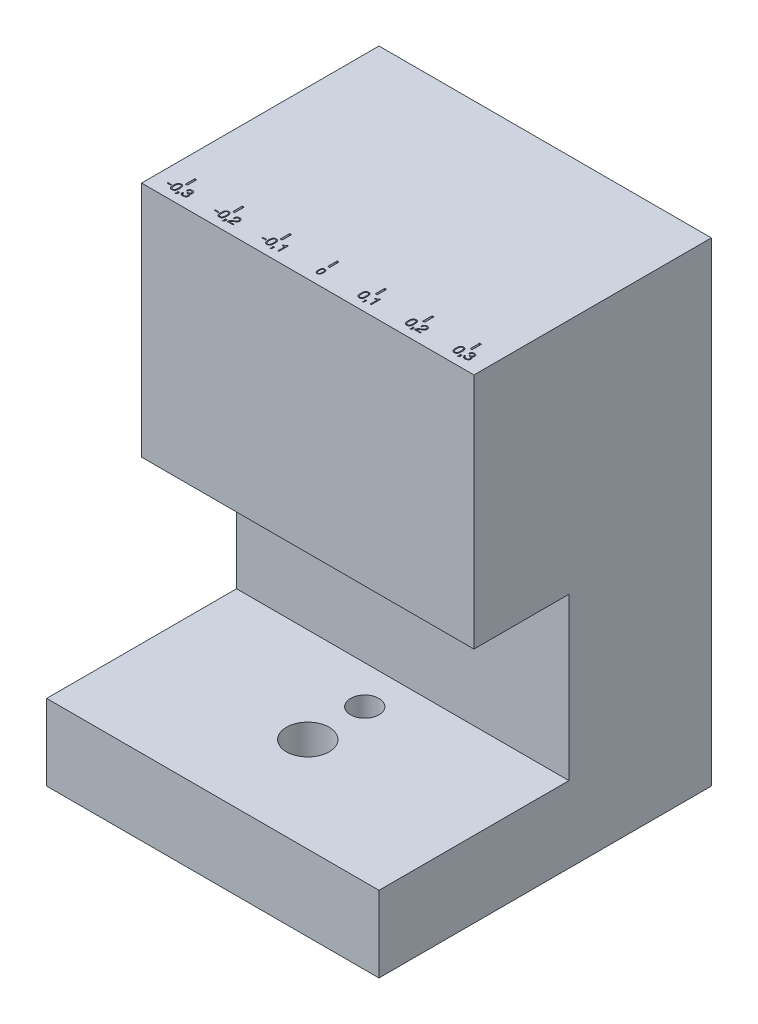
from build123d import *

# Parameters (mm, degrees)
SKETCH1_W           = 35
SKETCH1_H           = 35
BOSS_EXTRUDE1_DEPTH = 50
SKETCH2_W           = 35
SKETCH2_H           = 42
CUT_EXTRUDE1_DEPTH  = 10
SKETCH3_W           = 35
SKETCH3_H           = 17
CUT_EXTRUDE2_DEPTH  = 10
CUT_EXTRUDE3_REACH  = 57.79
SKETCH5_R           = 1.5
CUT_EXTRUDE4_REACH  = 57.79
SKETCH6_R           = 2.25
SKETCH13_W          = 0.2
SKETCH13_H          = 1
CUT_EXTRUDE5_DEPTH  = 1
SKETCH7_W           = 0.2
SKETCH7_H           = 1
SKETCH7_W_2         = 0.40523539
SKETCH7_H_2         = 0.103896104
CUT_EXTRUDE6_DEPTH  = 1
SKETCH10_W          = 0.2
SKETCH10_H          = 1
SKETCH10_W_2        = 0.40523539
SKETCH10_H_2        = 0.103896104
CUT_EXTRUDE7_DEPTH  = 1
SKETCH12_W          = 0.2
SKETCH12_H          = 1
SKETCH12_W_2        = 0.40523539
SKETCH12_H_2        = 0.103896104
CUT_EXTRUDE8_DEPTH  = 1
SKETCH14_W          = 0.2
SKETCH14_H          = 1
CUT_EXTRUDE9_DEPTH  = 1
SKETCH15_W          = 0.2
SKETCH15_H          = 1
CUT_EXTRUDE10_DEPTH = 1
SKETCH16_W          = 0.2
SKETCH16_H          = 1
CUT_EXTRUDE11_DEPTH = 1


with BuildPart() as part:
    # Sketch1 → Boss-Extrude1 (new body)
    with BuildSketch(Plane(origin=(0, 0, 0), x_dir=(1, 0, 0), z_dir=(0, 1, 0))):
        Rectangle(SKETCH1_W, SKETCH1_H)
    extrude(amount=BOSS_EXTRUDE1_DEPTH)

    # Sketch2 → Cut-Extrude1 (cut)
    with BuildSketch(Plane.XY.offset(17.5)):
        with Locations((0, 29)):
            Rectangle(SKETCH2_W, SKETCH2_H)
    extrude(amount=-CUT_EXTRUDE1_DEPTH, mode=Mode.SUBTRACT)

    # Sketch3 → Cut-Extrude2 (cut)
    with BuildSketch(Plane.XY.offset(7.5)):
        with Locations((0, 16.5)):
            Rectangle(SKETCH3_W, SKETCH3_H)
    extrude(amount=-CUT_EXTRUDE2_DEPTH, mode=Mode.SUBTRACT)

    # Sketch5 → Cut-Extrude3 (cut, up to next)
    with BuildSketch(Plane.XZ, mode=Mode.PRIVATE) as cut_extrude3_sk1:
        with Locations(Location((0, 1.5, 0), (0, 0, 270))):
            Circle(SKETCH5_R)
    cut_extrude3_tool1 = extrude(cut_extrude3_sk1.sketch, amount=-CUT_EXTRUDE3_REACH, mode=Mode.PRIVATE) & part.part
    add(cut_extrude3_tool1.solids().sort_by_distance((0, 0, 1.5))[0], mode=Mode.SUBTRACT)

    # Sketch6 → Cut-Extrude4 (cut, up to next)
    with BuildSketch(Plane.XZ, mode=Mode.PRIVATE) as cut_extrude4_sk1:
        with Locations(Location((0, 7.5, 0), (0, 0, 270))):
            Circle(SKETCH6_R)
    cut_extrude4_tool1 = extrude(cut_extrude4_sk1.sketch, amount=-CUT_EXTRUDE4_REACH, mode=Mode.PRIVATE) & part.part
    add(cut_extrude4_tool1.solids().sort_by_distance((0, 0, 7.5))[0], mode=Mode.SUBTRACT)

    # Sketch13 → Cut-Extrude5 (cut)
    # profile 1 of 2: a face of its own
    with BuildSketch(Plane(origin=(0, 50, 0), x_dir=(1, 0, 0), z_dir=(0, 1, 0))):
        with Locations((0, -4.8)):
            Rectangle(SKETCH13_W, SKETCH13_H)
    # profile 2 of 2: a face of its own
    with BuildSketch(Plane(origin=(0, 50, 0), x_dir=(1, 0, 0), z_dir=(0, 1, 0))):
        with BuildLine():
            add(Edge.make_bspline(
                [(-0.25974026, -6.105681818), (-0.259418248, -6.083167607), (-0.258761988, -6.03728367), (-0.255356716, -5.979728149), (-0.249814015, -5.933521917), (-0.24327359, -5.899865168), (-0.233907113, -5.867753809), (-0.222359011, -5.837135008), (-0.207908537, -5.808421983), (-0.189773284, -5.782358609), (-0.168572095, -5.758760814), (-0.148109883, -5.74156001), (-0.130034646, -5.729362804), (-0.115068051, -5.721441945), (-0.098878277, -5.714734513), (-0.081402313, -5.709434743), (-0.062730977, -5.705253618), (-0.042889252, -5.702153152), (-0.021839298, -5.700392239), (-0.007416677, -5.700133205), (0, -5.7)],
                knots=[0, 0, 0, 0, 2.205037761, 4.493864369, 5.64216971, 6.760441668, 7.847231071, 8.914069555, 9.961622874, 10.986204456, 12.014274766, 13.059869263, 13.594865583, 14.147243047, 14.715088115, 15.308471279, 15.933275722, 16.587587595, 17.273682202, 18, 18, 18, 18], degree=3))
            add(Edge.make_bspline(
                [(0, -5.7), (0.007416677, -5.700133205), (0.021839298, -5.700392239), (0.042889252, -5.702153152), (0.062730977, -5.705253618), (0.081402313, -5.709434743), (0.098878277, -5.714734513), (0.115068051, -5.721441945), (0.130034646, -5.729362804), (0.14810988, -5.741560011), (0.168572115, -5.758760811), (0.189773216, -5.782358617), (0.207908794, -5.808421953), (0.22235802, -5.837135126), (0.233910916, -5.867753359), (0.243258933, -5.8998669), (0.249869811, -5.933508667), (0.255044768, -5.979755266), (0.258856238, -6.037271744), (0.259449287, -6.083164856), (0.25974026, -6.105681818)],
                knots=[0, 0, 0, 0, 0.726329848, 1.412435836, 2.066758565, 2.691573372, 3.28496638, 3.852820869, 4.405207497, 4.940212693, 5.985824536, 7.013911901, 8.03851048, 9.086081178, 10.15293736, 11.239744793, 12.358035303, 13.505711418, 15.794925658, 18, 18, 18, 18], degree=3))
            add(Edge.make_bspline(
                [(0.25974026, -6.105681818), (0.259659721, -6.120564677), (0.259495364, -6.150936232), (0.257700464, -6.196852908), (0.254461725, -6.243243013), (0.247061085, -6.288669222), (0.236557994, -6.332448012), (0.224380645, -6.367110859), (0.212544845, -6.393273736), (0.201888766, -6.411468125), (0.189901009, -6.428622977), (0.17621855, -6.444424799), (0.160852133, -6.458827123), (0.143661695, -6.471736312), (0.124611121, -6.483094209), (0.103692154, -6.492854315), (0.0808794, -6.500980417), (0.055770087, -6.506297195), (0.028617154, -6.509812467), (0.009752374, -6.510192927), (0, -6.51038961)],
                knots=[0, 0, 0, 0, 1.460727674, 2.980917221, 4.510182221, 6.021708483, 7.492857034, 8.924144552, 9.620447327, 10.308250706, 10.990535755, 11.672076132, 12.355992481, 13.053914003, 13.778081013, 14.528928848, 15.316757794, 16.149228781, 17.043221558, 18, 18, 18, 18], degree=3))
            add(Edge.make_bspline(
                [(0, -6.51038961), (-0.00975222, -6.510192409), (-0.0286167, -6.509810947), (-0.055771715, -6.506302651), (-0.080923949, -6.500951255), (-0.103806984, -6.492881186), (-0.124752915, -6.48314665), (-0.143701963, -6.471634867), (-0.160996261, -6.458880782), (-0.176385034, -6.444471196), (-0.189886079, -6.428565997), (-0.201910636, -6.411481242), (-0.212503693, -6.393229436), (-0.224667531, -6.367209456), (-0.236394483, -6.332363302), (-0.247379944, -6.288725683), (-0.254306967, -6.243208657), (-0.258001777, -6.196870568), (-0.259423659, -6.150930149), (-0.259636135, -6.12056333), (-0.25974026, -6.105681818)],
                knots=[0, 0, 0, 0, 0.956650298, 1.85052334, 2.682882833, 3.475620761, 4.226368033, 4.945885891, 5.647964911, 6.331789661, 7.009774074, 7.691967743, 8.379679002, 9.078133222, 10.507464114, 11.979690131, 13.490183283, 15.019676863, 16.539467965, 18, 18, 18, 18], degree=3))
        make_face()
        with BuildLine():
            add(Edge.make_bspline(
                [(-0.166233766, -6.104707792), (-0.166195663, -6.112445931), (-0.166117318, -6.128356523), (-0.165683657, -6.152876129), (-0.164530243, -6.178732274), (-0.163706932, -6.205609026), (-0.161453852, -6.232818118), (-0.157832229, -6.259573549), (-0.152347677, -6.28545276), (-0.145790695, -6.310447106), (-0.136887489, -6.334064488), (-0.125676013, -6.355946735), (-0.112108881, -6.375960611), (-0.098824367, -6.390907333), (-0.08701773, -6.401706879), (-0.076987083, -6.408462611), (-0.066270464, -6.414391371), (-0.05462593, -6.419041822), (-0.042213072, -6.422867333), (-0.028864415, -6.425336713), (-0.014709648, -6.427061766), (-0.004984002, -6.427201248), (0, -6.427272727)],
                knots=[0, 0, 0, 0, 1.133900204, 2.331442386, 3.59307904, 4.926336811, 6.270958047, 7.591922008, 8.87952875, 10.145220324, 11.374882226, 12.569980629, 13.73998454, 14.908133072, 15.492207338, 16.079448505, 16.675562412, 17.283684373, 17.913293076, 18.575747323, 19.27012787, 20, 20, 20, 20], degree=3))
            add(Edge.make_bspline(
                [(0, -6.427272727), (0.004983651, -6.427199603), (0.014708611, -6.427056911), (0.028815456, -6.425361034), (0.042146476, -6.42281653), (0.05457816, -6.419069833), (0.066240033, -6.414432107), (0.076851858, -6.408413875), (0.086857776, -6.40171205), (0.098664804, -6.390907366), (0.111929928, -6.375911533), (0.125685461, -6.355995496), (0.136932667, -6.334096849), (0.145533052, -6.310382301), (0.152419706, -6.285487668), (0.157793646, -6.25956649), (0.161532725, -6.232829316), (0.163424397, -6.205594505), (0.164601184, -6.178738467), (0.165666172, -6.152875198), (0.166121329, -6.128356737), (0.166196975, -6.112446001), (0.166233766, -6.104707792)],
                knots=[0, 0, 0, 0, 0.730004103, 1.424510206, 2.079302176, 2.716619491, 3.32485141, 3.914123092, 4.501470442, 5.085650319, 6.254010071, 7.428704771, 8.624019268, 9.851113292, 11.11914349, 12.406983052, 13.728185865, 15.072418735, 16.406271272, 17.668136051, 18.865894768, 20, 20, 20, 20], degree=3))
            add(Edge.make_bspline(
                [(0.166233766, -6.104707792), (0.166192419, -6.094371999), (0.166105825, -6.07272535), (0.165711736, -6.039221537), (0.164448086, -6.00411948), (0.160214398, -5.968681402), (0.154178802, -5.933612126), (0.147076036, -5.905057458), (0.140060486, -5.883036819), (0.133620878, -5.867536146), (0.125740427, -5.853277736), (0.117003681, -5.839942796), (0.106851476, -5.827927423), (0.095591789, -5.816933828), (0.083061208, -5.80720014), (0.069335975, -5.798689504), (0.054283378, -5.791545382), (0.037551324, -5.786542959), (0.019257891, -5.783638866), (0.006558452, -5.783294649), (0, -5.783116883)],
                knots=[0, 0, 0, 0, 1.366831982, 2.862608927, 4.431425665, 6.008787706, 7.578240838, 9.135081137, 9.895447303, 10.633080208, 11.350404644, 12.047049209, 12.73789922, 13.426149947, 14.124703131, 14.831672702, 15.558394725, 16.321282284, 17.133049184, 18, 18, 18, 18], degree=3))
            add(Edge.make_bspline(
                [(0, -5.783116883), (-0.006558176, -5.783295293), (-0.019257082, -5.783640757), (-0.037554246, -5.786536128), (-0.054320482, -5.791583048), (-0.06945914, -5.798651995), (-0.083208759, -5.807152352), (-0.095601659, -5.816989522), (-0.106856785, -5.82792055), (-0.117003106, -5.839944381), (-0.125737305, -5.853278342), (-0.133634563, -5.867531891), (-0.140013223, -5.883069709), (-0.147381114, -5.904982304), (-0.154002113, -5.933675139), (-0.160539456, -5.968640577), (-0.164290282, -6.004142518), (-0.166012815, -6.039211988), (-0.166039442, -6.072727816), (-0.166170965, -6.094372587), (-0.166233766, -6.104707792)],
                knots=[0, 0, 0, 0, 0.866849653, 1.67852183, 2.441320369, 3.174446023, 3.881333099, 4.574174661, 5.262345078, 5.953114475, 6.649677749, 7.366918483, 8.104465315, 8.866995334, 10.421926313, 11.992451874, 13.568834347, 15.137810688, 16.633327511, 18, 18, 18, 18], degree=3))
        make_face(mode=Mode.SUBTRACT)
    extrude(amount=-CUT_EXTRUDE5_DEPTH, mode=Mode.SUBTRACT)

    # Sketch7 → Cut-Extrude6 (cut)
    # profile 1 of 5: a face of its own
    with BuildSketch(Plane(origin=(0, 50, 0), x_dir=(1, 0, 0), z_dir=(0, 1, 0))):
        with Locations((-15, -4.8)):
            Rectangle(SKETCH7_W, SKETCH7_H)
    # profile 2 of 5: a face of its own
    with BuildSketch(Plane(origin=(0, 50, 0), x_dir=(1, 0, 0), z_dir=(0, 1, 0))):
        with Locations((-15.973924513, -6.11038961)):
            Rectangle(SKETCH7_W_2, SKETCH7_H_2)
    # profile 3 of 5: a face of its own
    with BuildSketch(Plane(origin=(0, 50, 0), x_dir=(1, 0, 0), z_dir=(0, 1, 0))):
        with BuildLine():
            add(Edge.make_bspline(
                [(-15.636363636, -6.007102273), (-15.635961121, -5.978959508), (-15.635140796, -5.921604588), (-15.630884206, -5.849660187), (-15.62395583, -5.791902397), (-15.6157803, -5.74983146), (-15.604072202, -5.709692261), (-15.589637076, -5.67141876), (-15.571573983, -5.635527479), (-15.548904917, -5.602948262), (-15.522403431, -5.573451017), (-15.496825665, -5.551950013), (-15.474231619, -5.536703505), (-15.455523376, -5.526802431), (-15.435286157, -5.518418141), (-15.413441203, -5.511793429), (-15.390102033, -5.506567023), (-15.365299877, -5.50269144), (-15.338987434, -5.500490298), (-15.320959158, -5.500166506), (-15.311688312, -5.5)],
                knots=[0, 0, 0, 0, 2.205037761, 4.493864369, 5.64216971, 6.760441668, 7.847231071, 8.914069555, 9.961622874, 10.986204456, 12.014274766, 13.059869263, 13.594865583, 14.147243047, 14.715088115, 15.308471279, 15.933275722, 16.587587595, 17.273682202, 18, 18, 18, 18], degree=3))
            add(Edge.make_bspline(
                [(-15.311688312, -5.5), (-15.302417465, -5.500166506), (-15.284389189, -5.500490298), (-15.258076746, -5.50269144), (-15.23327459, -5.506567023), (-15.20993542, -5.511793429), (-15.188090466, -5.518418141), (-15.167853248, -5.526802431), (-15.149145004, -5.536703505), (-15.126550962, -5.551950013), (-15.100973168, -5.573451014), (-15.074471792, -5.602948272), (-15.051802319, -5.635527441), (-15.033740787, -5.671418907), (-15.019299667, -5.709691699), (-15.007614646, -5.749833626), (-14.999351048, -5.791885833), (-14.992882352, -5.849694082), (-14.988118014, -5.92158968), (-14.987376703, -5.97895607), (-14.987012987, -6.007102273)],
                knots=[0, 0, 0, 0, 0.726329848, 1.412435836, 2.066758565, 2.691573372, 3.28496638, 3.852820869, 4.405207497, 4.940212693, 5.985824536, 7.013911901, 8.03851048, 9.086081178, 10.15293736, 11.239744793, 12.358035303, 13.505711418, 15.794925658, 18, 18, 18, 18], degree=3))
            add(Edge.make_bspline(
                [(-14.987012987, -6.007102273), (-14.987113661, -6.025705847), (-14.987319106, -6.06367029), (-14.989562732, -6.121066134), (-14.993611156, -6.179053766), (-15.002861955, -6.235836528), (-15.015990819, -6.290560015), (-15.031212506, -6.333888574), (-15.046007256, -6.36659217), (-15.059327354, -6.389335156), (-15.074312051, -6.410778722), (-15.091415124, -6.430530998), (-15.110623145, -6.448533904), (-15.132111193, -6.464670391), (-15.155924411, -6.478867761), (-15.182073119, -6.491067894), (-15.210589062, -6.501225522), (-15.241975702, -6.507871494), (-15.27591687, -6.512265583), (-15.299497844, -6.512741159), (-15.311688312, -6.512987013)],
                knots=[0, 0, 0, 0, 1.460727674, 2.980917221, 4.510182221, 6.021708483, 7.492857034, 8.924144552, 9.620447327, 10.308250706, 10.990535755, 11.672076132, 12.355992481, 13.053914003, 13.778081013, 14.528928848, 15.316757794, 16.149228781, 17.043221558, 18, 18, 18, 18], degree=3))
            add(Edge.make_bspline(
                [(-15.311688312, -6.512987013), (-15.323878587, -6.512740511), (-15.347459187, -6.512263684), (-15.381402955, -6.507878314), (-15.412843248, -6.501189068), (-15.441447042, -6.491101483), (-15.467629456, -6.478933313), (-15.491315766, -6.464543584), (-15.512933638, -6.448600978), (-15.532169605, -6.430588995), (-15.549045911, -6.410707496), (-15.564076606, -6.389351552), (-15.577317929, -6.366536794), (-15.592522725, -6.33401182), (-15.607181415, -6.290454127), (-15.620913241, -6.235907104), (-15.629572021, -6.179010822), (-15.634190532, -6.12108821), (-15.635967886, -6.063662687), (-15.63623348, -6.025704162), (-15.636363636, -6.007102273)],
                knots=[0, 0, 0, 0, 0.956650298, 1.85052334, 2.682882833, 3.475620761, 4.226368033, 4.945885891, 5.647964911, 6.331789661, 7.009774074, 7.691967743, 8.379679002, 9.078133222, 10.507464114, 11.979690131, 13.490183283, 15.019676863, 16.539467965, 18, 18, 18, 18], degree=3))
        make_face()
        with BuildLine():
            add(Edge.make_bspline(
                [(-15.519480519, -6.00588474), (-15.51943289, -6.015557413), (-15.519334959, -6.035445654), (-15.518792883, -6.066095161), (-15.517351116, -6.098415342), (-15.516321976, -6.132011283), (-15.513505626, -6.166022648), (-15.508978598, -6.199466936), (-15.502122908, -6.23181595), (-15.493926681, -6.263058882), (-15.482797673, -6.29258061), (-15.468783328, -6.319933418), (-15.451824412, -6.344950764), (-15.435218771, -6.363634167), (-15.420460474, -6.377133599), (-15.407922165, -6.385578264), (-15.394526391, -6.392989214), (-15.379970724, -6.398802278), (-15.364454652, -6.403584167), (-15.34776883, -6.406670891), (-15.330075372, -6.408827207), (-15.317918314, -6.40900156), (-15.311688312, -6.409090909)],
                knots=[0, 0, 0, 0, 1.133900204, 2.331442386, 3.59307904, 4.926336811, 6.270958047, 7.591922008, 8.87952875, 10.145220324, 11.374882226, 12.569980629, 13.73998454, 14.908133072, 15.492207338, 16.079448505, 16.675562412, 17.283684373, 17.913293076, 18.575747323, 19.27012787, 20, 20, 20, 20], degree=3))
            add(Edge.make_bspline(
                [(-15.311688312, -6.409090909), (-15.305458748, -6.408999504), (-15.293302547, -6.408821138), (-15.275668992, -6.406701293), (-15.259005217, -6.403520663), (-15.243465612, -6.398837292), (-15.228888271, -6.393040134), (-15.215623489, -6.385517344), (-15.203116092, -6.377140062), (-15.188357307, -6.363634208), (-15.171775902, -6.344889417), (-15.154581485, -6.319994369), (-15.140522477, -6.292621061), (-15.129771996, -6.262977876), (-15.12116368, -6.231859585), (-15.114446254, -6.199458112), (-15.109772405, -6.166036645), (-15.107407816, -6.131993131), (-15.105936832, -6.098423084), (-15.104605597, -6.066093997), (-15.104036651, -6.035445921), (-15.103942092, -6.015557501), (-15.103896104, -6.00588474)],
                knots=[0, 0, 0, 0, 0.730004103, 1.424510206, 2.079302176, 2.716619491, 3.32485141, 3.914123092, 4.501470442, 5.085650319, 6.254010071, 7.428704771, 8.624019268, 9.851113292, 11.11914349, 12.406983052, 13.728185865, 15.072418735, 16.406271272, 17.668136051, 18.865894768, 20, 20, 20, 20], degree=3))
            add(Edge.make_bspline(
                [(-15.103896104, -6.00588474), (-15.103947788, -5.992964999), (-15.104056031, -5.965906687), (-15.104548642, -5.924026921), (-15.106128204, -5.88014935), (-15.111420314, -5.835851753), (-15.118964809, -5.792015157), (-15.127843267, -5.756321822), (-15.136612704, -5.728796024), (-15.144662215, -5.709420182), (-15.154512778, -5.69159717), (-15.16543371, -5.674928494), (-15.178123967, -5.659909279), (-15.192198576, -5.646167285), (-15.207861802, -5.634000175), (-15.225018343, -5.62336188), (-15.243834089, -5.614431727), (-15.264749156, -5.608178699), (-15.287615949, -5.604548582), (-15.303490247, -5.604118311), (-15.311688312, -5.603896104)],
                knots=[0, 0, 0, 0, 1.366831982, 2.862608927, 4.431425665, 6.008787706, 7.578240838, 9.135081137, 9.895447303, 10.633080208, 11.350404644, 12.047049209, 12.73789922, 13.426149947, 14.124703131, 14.831672702, 15.558394725, 16.321282284, 17.133049184, 18, 18, 18, 18], degree=3))
            add(Edge.make_bspline(
                [(-15.311688312, -5.603896104), (-15.319886032, -5.604119116), (-15.335759664, -5.604550946), (-15.358631119, -5.60817016), (-15.379588914, -5.61447881), (-15.398512237, -5.623314994), (-15.41569926, -5.63394044), (-15.431190385, -5.646236902), (-15.445259292, -5.659900687), (-15.457942194, -5.674930476), (-15.468859944, -5.691597928), (-15.478731516, -5.709414864), (-15.48670484, -5.728837137), (-15.495914704, -5.75622788), (-15.504190953, -5.792093923), (-15.512362631, -5.835800721), (-15.517051164, -5.880178148), (-15.519204331, -5.924014985), (-15.519237614, -5.96590977), (-15.519402018, -5.992965734), (-15.519480519, -6.00588474)],
                knots=[0, 0, 0, 0, 0.866849653, 1.67852183, 2.441320369, 3.174446023, 3.881333099, 4.574174661, 5.262345078, 5.953114475, 6.649677749, 7.366918483, 8.104465315, 8.866995334, 10.421926313, 11.992451874, 13.568834347, 15.137810688, 16.633327511, 18, 18, 18, 18], degree=3))
        make_face(mode=Mode.SUBTRACT)
    # profile 4 of 5: a face of its own
    with BuildSketch(Plane(origin=(0, 50, 0), x_dir=(1, 0, 0), z_dir=(0, 1, 0))):
        with BuildLine():
            Line((-14.805194805, -6.344155844), (-14.649350649, -6.344155844))
            Line((-14.649350649, -6.344155844), (-14.649350649, -6.486607143))
            add(Edge.make_bspline(
                [(-14.649350649, -6.486607143), (-14.649731817, -6.499560008), (-14.650472075, -6.524715542), (-14.657595286, -6.561132986), (-14.669119485, -6.59487602), (-14.68268417, -6.620785805), (-14.696015334, -6.639548701), (-14.707239496, -6.652711537), (-14.720038203, -6.664688946), (-14.734454744, -6.675415222), (-14.749922368, -6.685443709), (-14.767114261, -6.693904387), (-14.78546986, -6.701743274), (-14.798523253, -6.705746282), (-14.805194805, -6.707792208)],
                knots=[0, 0, 0, 0, 1.587545627, 3.083144892, 4.531711732, 5.949700105, 6.651948841, 7.352184625, 8.068413695, 8.796986288, 9.554335728, 10.326228829, 11.14454025, 12, 12, 12, 12], degree=3))
            Line((-14.805194805, -6.707792208), (-14.805194805, -6.637175325))
            add(Edge.make_bspline(
                [(-14.805194805, -6.637175325), (-14.797712283, -6.634050314), (-14.783300633, -6.628031414), (-14.764997662, -6.613857692), (-14.750534227, -6.597081412), (-14.739549084, -6.578179051), (-14.731802756, -6.558151324), (-14.726637352, -6.537968124), (-14.723520385, -6.518562551), (-14.723725845, -6.505961722), (-14.723823052, -6.5)],
                knots=[0, 0, 0, 0, 1.136238689, 2.188443232, 3.220324315, 4.235181231, 5.247448654, 6.230413457, 7.162770744, 8, 8, 8, 8], degree=3))
            Line((-14.723823052, -6.5), (-14.805194805, -6.5))
            Line((-14.805194805, -6.5), (-14.805194805, -6.344155844))
        make_face()
    # profile 5 of 5: a face of its own
    with BuildSketch(Plane(origin=(0, 50, 0), x_dir=(1, 0, 0), z_dir=(0, 1, 0))):
        with BuildLine():
            add(Edge.make_bspline(
                [(-14.228287338, -5.927150974), (-14.22375807, -5.927539421), (-14.214912228, -5.928298074), (-14.206035965, -5.928481783), (-14.201704545, -5.928571429)],
                knots=[0, 0, 0, 0, 1.024044541, 2, 2, 2, 2], degree=3))
            add(Edge.make_bspline(
                [(-14.201704545, -5.928571429), (-14.197510823, -5.928571429), (-14.189055736, -5.928571429), (-14.180600649, -5.928571429), (-14.176339286, -5.928571429)],
                knots=[0, 0, 0, 0, 0.992, 2, 2, 2, 2], degree=3))
            add(Edge.make_bspline(
                [(-14.176339286, -5.928571429), (-14.163986934, -5.928081845), (-14.139628994, -5.927116421), (-14.109987617, -5.920271993), (-14.087689565, -5.912360679), (-14.071829192, -5.905476277), (-14.057389928, -5.896647421), (-14.043626421, -5.887280136), (-14.031342125, -5.876267558), (-14.020168447, -5.864167786), (-14.010520527, -5.85077094), (-14.002023664, -5.836246212), (-13.995312894, -5.82030046), (-13.990448241, -5.802998689), (-13.987600934, -5.784319752), (-13.987213086, -5.771452049), (-13.987012987, -5.764813312)],
                knots=[0, 0, 0, 0, 1.844572572, 3.637363335, 4.516636355, 5.380904015, 6.214841212, 7.04219613, 7.865774989, 8.67432606, 9.499330709, 10.328166574, 11.184355677, 12.077238401, 13.008004106, 14, 14, 14, 14], degree=3))
            add(Edge.make_bspline(
                [(-13.987012987, -5.764813312), (-13.987181578, -5.758382556), (-13.987507413, -5.745953847), (-13.989658195, -5.72783124), (-13.993806966, -5.71101373), (-13.999193594, -5.695222664), (-14.006401749, -5.680776733), (-14.014913503, -5.667335939), (-14.025390812, -5.655406186), (-14.037193805, -5.644621259), (-14.050195462, -5.635149994), (-14.064003894, -5.626848164), (-14.07855972, -5.619622769), (-14.093918262, -5.613799389), (-14.110137443, -5.609221044), (-14.127162611, -5.606403626), (-14.144895133, -5.604148549), (-14.156986167, -5.603981337), (-14.163149351, -5.603896104)],
                knots=[0, 0, 0, 0, 1.144634207, 2.212232447, 3.239994221, 4.222263092, 5.175177034, 6.106790253, 7.045608871, 7.9914248, 8.947299642, 9.903174483, 10.856088425, 11.835328217, 12.822527043, 13.849724655, 14.903936411, 16, 16, 16, 16], degree=3))
            add(Edge.make_bspline(
                [(-14.163149351, -5.603896104), (-14.171074535, -5.604145032), (-14.186318503, -5.604623841), (-14.208405441, -5.607867595), (-14.228690735, -5.613451467), (-14.247161521, -5.621506296), (-14.263847137, -5.631372099), (-14.279249873, -5.642542958), (-14.293045533, -5.655433438), (-14.305530032, -5.669639793), (-14.316246033, -5.685404287), (-14.325665011, -5.702363663), (-14.33358952, -5.720634397), (-14.339755251, -5.7401209), (-14.344652195, -5.760399319), (-14.347987136, -5.781371653), (-14.350416665, -5.802838363), (-14.350571435, -5.81736312), (-14.350649351, -5.824675325)],
                knots=[0, 0, 0, 0, 1.164239933, 2.239397273, 3.271389092, 4.246146225, 5.190385564, 6.114646012, 7.035856176, 7.958565985, 8.887515976, 9.830551762, 10.805308896, 11.807836183, 12.8298271, 13.867259283, 14.926313339, 16, 16, 16, 16], degree=3))
            Line((-14.350649351, -5.824675325), (-14.467532468, -5.824675325))
            add(Edge.make_bspline(
                [(-14.467532468, -5.824675325), (-14.466898676, -5.812889402), (-14.465655904, -5.789778923), (-14.460796681, -5.755974808), (-14.454303919, -5.723699475), (-14.4452381, -5.693149116), (-14.434487367, -5.664308312), (-14.42121539, -5.637635305), (-14.405927236, -5.613046763), (-14.38842785, -5.590618536), (-14.368611804, -5.570328672), (-14.346341033, -5.55245581), (-14.321889463, -5.536737293), (-14.29515475, -5.523525681), (-14.266216821, -5.512858026), (-14.234934269, -5.505529215), (-14.201587621, -5.500644811), (-14.178589772, -5.500218507), (-14.166801948, -5.5)],
                knots=[0, 0, 0, 0, 1.136292756, 2.228104716, 3.286056069, 4.304473189, 5.294230083, 6.24697231, 7.168900078, 8.07856907, 8.981541137, 9.89421469, 10.823114002, 11.775856229, 12.761056959, 13.786576069, 14.865482921, 16, 16, 16, 16], degree=3))
            add(Edge.make_bspline(
                [(-14.166801948, -5.5), (-14.156444998, -5.500186453), (-14.136090918, -5.500552881), (-14.106117697, -5.5036959), (-14.07727807, -5.508699434), (-14.049595925, -5.515831295), (-14.023318164, -5.524803992), (-13.99868555, -5.536049825), (-13.976016846, -5.549439808), (-13.955034786, -5.564753047), (-13.936100148, -5.582305169), (-13.919038758, -5.602028134), (-13.904706497, -5.624447211), (-13.892228476, -5.648847059), (-13.882226302, -5.675569422), (-13.875189888, -5.704652215), (-13.870881845, -5.736004512), (-13.870385546, -5.757696694), (-13.87012987, -5.768871753)],
                knots=[0, 0, 0, 0, 1.094732236, 2.151431358, 3.182533036, 4.186799962, 5.170590493, 6.114588521, 7.044256872, 7.949651489, 8.855497872, 9.768458083, 10.698731346, 11.661397658, 12.661607955, 13.707483321, 14.818974943, 16, 16, 16, 16], degree=3))
            add(Edge.make_bspline(
                [(-13.87012987, -5.768871753), (-13.870559369, -5.779741502), (-13.87140503, -5.801143468), (-13.879321237, -5.832344572), (-13.891952548, -5.861827842), (-13.909597839, -5.889064766), (-13.930490841, -5.913817025), (-13.954114997, -5.935374661), (-13.979495145, -5.954365674), (-13.998283694, -5.963808863), (-14.007711039, -5.968547078)],
                knots=[0, 0, 0, 0, 1.018273201, 2.004926621, 2.99991324, 4.015750969, 5.037991598, 6.030566763, 7.011816962, 8, 8, 8, 8], degree=3))
            Line((-14.007711039, -5.968547078), (-14.007711039, -5.971387987))
            add(Edge.make_bspline(
                [(-14.007711039, -5.971387987), (-14.000313566, -5.973187953), (-13.985786301, -5.976722752), (-13.96479142, -5.983536247), (-13.945231203, -5.992176152), (-13.926901545, -6.002052776), (-13.909975346, -6.013547315), (-13.894192625, -6.026290417), (-13.880075517, -6.040850049), (-13.866993027, -6.056438515), (-13.85557212, -6.073226059), (-13.845464199, -6.090745245), (-13.837308704, -6.109142203), (-13.829948167, -6.127985206), (-13.824836671, -6.147839308), (-13.820894669, -6.168362012), (-13.818697522, -6.189684643), (-13.818355055, -6.204135067), (-13.818181818, -6.211444805)],
                knots=[0, 0, 0, 0, 1.096277728, 2.152885886, 3.173635358, 4.171871576, 5.147220894, 6.116372497, 7.087626967, 8.062976285, 9.04380718, 10.008001454, 10.971408067, 11.939383991, 12.917647705, 13.918779088, 14.947215663, 16, 16, 16, 16], degree=3))
            add(Edge.make_bspline(
                [(-13.818181818, -6.211444805), (-13.81843362, -6.22344051), (-13.81892421, -6.246811968), (-13.824481115, -6.28073167), (-13.832814459, -6.312602782), (-13.844896685, -6.342097014), (-13.859840958, -6.369212012), (-13.877085778, -6.394128328), (-13.896959898, -6.416609138), (-13.919116088, -6.436696868), (-13.943478431, -6.454500679), (-13.969931567, -6.469846616), (-13.998354033, -6.483173911), (-14.02862312, -6.493958814), (-14.060379517, -6.502523242), (-14.093230835, -6.508521972), (-14.127075565, -6.51231332), (-14.149949312, -6.512760626), (-14.161525974, -6.512987013)],
                knots=[0, 0, 0, 0, 1.119238991, 2.180634497, 3.201166609, 4.190044429, 5.148429885, 6.08770101, 7.014139374, 7.944296016, 8.875481687, 9.826720683, 10.796035812, 11.803106655, 12.823638768, 13.864381399, 14.919139346, 16, 16, 16, 16], degree=3))
            add(Edge.make_bspline(
                [(-14.161525974, -6.512987013), (-14.173916097, -6.51271328), (-14.198155895, -6.512177755), (-14.233579611, -6.508019902), (-14.267292713, -6.501416008), (-14.299153391, -6.491873575), (-14.329023178, -6.479771423), (-14.356651473, -6.465002136), (-14.38212473, -6.448007717), (-14.405209103, -6.428398512), (-14.425827877, -6.406332951), (-14.44395685, -6.381902603), (-14.459423488, -6.355034287), (-14.472524803, -6.326016029), (-14.482360748, -6.294510801), (-14.489507648, -6.260971582), (-14.493362126, -6.225268228), (-14.493457577, -6.200833885), (-14.493506494, -6.188311688)],
                knots=[0, 0, 0, 0, 1.127923541, 2.206647799, 3.24301031, 4.252374553, 5.230262042, 6.172590944, 7.100151303, 8.013368993, 8.92409098, 9.84426063, 10.777040978, 11.741963846, 12.737306752, 13.77615525, 14.860316395, 16, 16, 16, 16], degree=3))
            Line((-14.493506494, -6.188311688), (-14.376623377, -6.188311688))
            add(Edge.make_bspline(
                [(-14.376623377, -6.188311688), (-14.376179839, -6.196232731), (-14.375308927, -6.21178619), (-14.372356962, -6.234625457), (-14.367377563, -6.256288127), (-14.361233307, -6.276959229), (-14.352981158, -6.296333419), (-14.343252957, -6.314588184), (-14.332008855, -6.331845968), (-14.319107148, -6.347841917), (-14.304461342, -6.362259405), (-14.28835253, -6.374993501), (-14.270498536, -6.385672528), (-14.250972279, -6.394028972), (-14.230003442, -6.400852982), (-14.207434863, -6.405673376), (-14.183242361, -6.408487911), (-14.16660656, -6.408886517), (-14.158076299, -6.409090909)],
                knots=[0, 0, 0, 0, 1.086422789, 2.133258643, 3.149139292, 4.127887893, 5.082802671, 6.02773415, 6.957881927, 7.899765892, 8.836533368, 9.766865662, 10.705829332, 11.676565733, 12.669720311, 13.721789968, 14.831813013, 16, 16, 16, 16], degree=3))
            add(Edge.make_bspline(
                [(-14.158076299, -6.409090909), (-14.150696824, -6.408936397), (-14.136032767, -6.408629359), (-14.114320632, -6.406125807), (-14.093149311, -6.402083632), (-14.072640258, -6.396418547), (-14.053022671, -6.389147298), (-14.034568427, -6.380431992), (-14.017354247, -6.370435716), (-14.001470068, -6.359078547), (-13.986984301, -6.346224033), (-13.973989122, -6.332014365), (-13.962510084, -6.316469652), (-13.952721429, -6.299549905), (-13.944807298, -6.28132945), (-13.939058504, -6.261925367), (-13.935831017, -6.241381851), (-13.935324284, -6.227351342), (-13.935064935, -6.220170455)],
                knots=[0, 0, 0, 0, 1.084322363, 2.154701418, 3.207532467, 4.249465279, 5.278033306, 6.278596232, 7.245351124, 8.199915329, 9.143546068, 10.086443401, 11.024928266, 11.978093765, 12.953195191, 13.937777553, 14.9445439, 16, 16, 16, 16], degree=3))
            add(Edge.make_bspline(
                [(-13.935064935, -6.220170455), (-13.93525033, -6.21277577), (-13.935613918, -6.198273695), (-13.939895251, -6.177288222), (-13.946329026, -6.157509263), (-13.955564594, -6.139284538), (-13.966708402, -6.12263455), (-13.978280392, -6.106799369), (-13.991499559, -6.092816537), (-14.00547606, -6.079895066), (-14.020743857, -6.068486976), (-14.037274996, -6.05869287), (-14.055125013, -6.050564767), (-14.074071725, -6.043883681), (-14.093964523, -6.039020227), (-14.114366639, -6.034891516), (-14.135451257, -6.033064316), (-14.149686966, -6.032667463), (-14.156858766, -6.032467532)],
                knots=[0, 0, 0, 0, 1.094737693, 2.14694312, 3.161734058, 4.170810617, 5.163813252, 6.130541859, 7.074320022, 8.011307363, 8.949956839, 9.894161134, 10.85441837, 11.853479033, 12.86772477, 13.888493691, 14.93624537, 16, 16, 16, 16], degree=3))
            add(Edge.make_bspline(
                [(-14.156858766, -6.032467532), (-14.169101732, -6.032467532), (-14.192911255, -6.032467532), (-14.216720779, -6.032467532), (-14.228287338, -6.032467532)],
                knots=[0, 0, 0, 0, 1.028409091, 2, 2, 2, 2], degree=3))
            Line((-14.228287338, -6.032467532), (-14.228287338, -5.927150974))
        make_face()
    extrude(amount=-CUT_EXTRUDE6_DEPTH, mode=Mode.SUBTRACT)

    # Sketch10 → Cut-Extrude7 (cut)
    # profile 1 of 5: a face of its own
    with BuildSketch(Plane(origin=(0, 50, 0), x_dir=(1, 0, 0), z_dir=(0, 1, 0))):
        with Locations((-10, -4.8)):
            Rectangle(SKETCH10_W, SKETCH10_H)
    # profile 2 of 5: a face of its own
    with BuildSketch(Plane(origin=(0, 50, 0), x_dir=(1, 0, 0), z_dir=(0, 1, 0))):
        with Locations((-10.973924513, -6.11038961)):
            Rectangle(SKETCH10_W_2, SKETCH10_H_2)
    # profile 3 of 5: a face of its own
    with BuildSketch(Plane(origin=(0, 50, 0), x_dir=(1, 0, 0), z_dir=(0, 1, 0))):
        with BuildLine():
            add(Edge.make_bspline(
                [(-10.636363636, -6.007102273), (-10.635961121, -5.978959508), (-10.635140796, -5.921604588), (-10.630884206, -5.849660187), (-10.62395583, -5.791902397), (-10.6157803, -5.74983146), (-10.604072202, -5.709692261), (-10.589637076, -5.67141876), (-10.571573983, -5.635527479), (-10.548904917, -5.602948262), (-10.522403431, -5.573451017), (-10.496825665, -5.551950013), (-10.474231619, -5.536703505), (-10.455523376, -5.526802431), (-10.435286157, -5.518418141), (-10.413441203, -5.511793429), (-10.390102033, -5.506567023), (-10.365299877, -5.50269144), (-10.338987434, -5.500490298), (-10.320959158, -5.500166506), (-10.311688312, -5.5)],
                knots=[0, 0, 0, 0, 2.205037761, 4.493864369, 5.64216971, 6.760441668, 7.847231071, 8.914069555, 9.961622874, 10.986204456, 12.014274766, 13.059869263, 13.594865583, 14.147243047, 14.715088115, 15.308471279, 15.933275722, 16.587587595, 17.273682202, 18, 18, 18, 18], degree=3))
            add(Edge.make_bspline(
                [(-10.311688312, -5.5), (-10.302417465, -5.500166506), (-10.284389189, -5.500490298), (-10.258076746, -5.50269144), (-10.23327459, -5.506567023), (-10.20993542, -5.511793429), (-10.188090466, -5.518418141), (-10.167853248, -5.526802431), (-10.149145004, -5.536703505), (-10.126550962, -5.551950013), (-10.100973168, -5.573451014), (-10.074471792, -5.602948272), (-10.051802319, -5.635527441), (-10.033740787, -5.671418907), (-10.019299667, -5.709691699), (-10.007614646, -5.749833626), (-9.999351048, -5.791885833), (-9.992882352, -5.849694082), (-9.988118014, -5.92158968), (-9.987376703, -5.97895607), (-9.987012987, -6.007102273)],
                knots=[0, 0, 0, 0, 0.726329848, 1.412435836, 2.066758565, 2.691573372, 3.28496638, 3.852820869, 4.405207497, 4.940212693, 5.985824536, 7.013911901, 8.03851048, 9.086081178, 10.15293736, 11.239744793, 12.358035303, 13.505711418, 15.794925658, 18, 18, 18, 18], degree=3))
            add(Edge.make_bspline(
                [(-9.987012987, -6.007102273), (-9.987113661, -6.025705847), (-9.987319106, -6.06367029), (-9.989562732, -6.121066134), (-9.993611156, -6.179053766), (-10.002861955, -6.235836528), (-10.015990819, -6.290560015), (-10.031212506, -6.333888574), (-10.046007256, -6.36659217), (-10.059327354, -6.389335156), (-10.074312051, -6.410778722), (-10.091415124, -6.430530998), (-10.110623145, -6.448533904), (-10.132111193, -6.464670391), (-10.155924411, -6.478867761), (-10.182073119, -6.491067894), (-10.210589062, -6.501225522), (-10.241975702, -6.507871494), (-10.27591687, -6.512265583), (-10.299497844, -6.512741159), (-10.311688312, -6.512987013)],
                knots=[0, 0, 0, 0, 1.460727674, 2.980917221, 4.510182221, 6.021708483, 7.492857034, 8.924144552, 9.620447327, 10.308250706, 10.990535755, 11.672076132, 12.355992481, 13.053914003, 13.778081013, 14.528928848, 15.316757794, 16.149228781, 17.043221558, 18, 18, 18, 18], degree=3))
            add(Edge.make_bspline(
                [(-10.311688312, -6.512987013), (-10.323878587, -6.512740511), (-10.347459187, -6.512263684), (-10.381402955, -6.507878314), (-10.412843248, -6.501189068), (-10.441447042, -6.491101483), (-10.467629456, -6.478933313), (-10.491315766, -6.464543584), (-10.512933638, -6.448600978), (-10.532169605, -6.430588995), (-10.549045911, -6.410707496), (-10.564076606, -6.389351552), (-10.577317929, -6.366536794), (-10.592522725, -6.33401182), (-10.607181415, -6.290454127), (-10.620913241, -6.235907104), (-10.629572021, -6.179010822), (-10.634190532, -6.12108821), (-10.635967886, -6.063662687), (-10.63623348, -6.025704162), (-10.636363636, -6.007102273)],
                knots=[0, 0, 0, 0, 0.956650298, 1.85052334, 2.682882833, 3.475620761, 4.226368033, 4.945885891, 5.647964911, 6.331789661, 7.009774074, 7.691967743, 8.379679002, 9.078133222, 10.507464114, 11.979690131, 13.490183283, 15.019676863, 16.539467965, 18, 18, 18, 18], degree=3))
        make_face()
        with BuildLine():
            add(Edge.make_bspline(
                [(-10.519480519, -6.00588474), (-10.51943289, -6.015557413), (-10.519334959, -6.035445654), (-10.518792883, -6.066095161), (-10.517351116, -6.098415342), (-10.516321976, -6.132011283), (-10.513505626, -6.166022648), (-10.508978598, -6.199466936), (-10.502122908, -6.23181595), (-10.493926681, -6.263058882), (-10.482797673, -6.29258061), (-10.468783328, -6.319933418), (-10.451824412, -6.344950764), (-10.435218771, -6.363634167), (-10.420460474, -6.377133599), (-10.407922165, -6.385578264), (-10.394526391, -6.392989214), (-10.379970724, -6.398802278), (-10.364454652, -6.403584167), (-10.34776883, -6.406670891), (-10.330075372, -6.408827207), (-10.317918314, -6.40900156), (-10.311688312, -6.409090909)],
                knots=[0, 0, 0, 0, 1.133900204, 2.331442386, 3.59307904, 4.926336811, 6.270958047, 7.591922008, 8.87952875, 10.145220324, 11.374882226, 12.569980629, 13.73998454, 14.908133072, 15.492207338, 16.079448505, 16.675562412, 17.283684373, 17.913293076, 18.575747323, 19.27012787, 20, 20, 20, 20], degree=3))
            add(Edge.make_bspline(
                [(-10.311688312, -6.409090909), (-10.305458748, -6.408999504), (-10.293302547, -6.408821138), (-10.275668992, -6.406701293), (-10.259005217, -6.403520663), (-10.243465612, -6.398837292), (-10.228888271, -6.393040134), (-10.215623489, -6.385517344), (-10.203116092, -6.377140062), (-10.188357307, -6.363634208), (-10.171775902, -6.344889417), (-10.154581485, -6.319994369), (-10.140522477, -6.292621061), (-10.129771996, -6.262977876), (-10.12116368, -6.231859585), (-10.114446254, -6.199458112), (-10.109772405, -6.166036645), (-10.107407816, -6.131993131), (-10.105936832, -6.098423084), (-10.104605597, -6.066093997), (-10.104036651, -6.035445921), (-10.103942092, -6.015557501), (-10.103896104, -6.00588474)],
                knots=[0, 0, 0, 0, 0.730004103, 1.424510206, 2.079302176, 2.716619491, 3.32485141, 3.914123092, 4.501470442, 5.085650319, 6.254010071, 7.428704771, 8.624019268, 9.851113292, 11.11914349, 12.406983052, 13.728185865, 15.072418735, 16.406271272, 17.668136051, 18.865894768, 20, 20, 20, 20], degree=3))
            add(Edge.make_bspline(
                [(-10.103896104, -6.00588474), (-10.103947788, -5.992964999), (-10.104056031, -5.965906687), (-10.104548642, -5.924026921), (-10.106128204, -5.88014935), (-10.111420314, -5.835851753), (-10.118964809, -5.792015157), (-10.127843267, -5.756321822), (-10.136612704, -5.728796024), (-10.144662215, -5.709420182), (-10.154512778, -5.69159717), (-10.16543371, -5.674928494), (-10.178123967, -5.659909279), (-10.192198576, -5.646167285), (-10.207861802, -5.634000175), (-10.225018343, -5.62336188), (-10.243834089, -5.614431727), (-10.264749156, -5.608178699), (-10.287615949, -5.604548582), (-10.303490247, -5.604118311), (-10.311688312, -5.603896104)],
                knots=[0, 0, 0, 0, 1.366831982, 2.862608927, 4.431425665, 6.008787706, 7.578240838, 9.135081137, 9.895447303, 10.633080208, 11.350404644, 12.047049209, 12.73789922, 13.426149947, 14.124703131, 14.831672702, 15.558394725, 16.321282284, 17.133049184, 18, 18, 18, 18], degree=3))
            add(Edge.make_bspline(
                [(-10.311688312, -5.603896104), (-10.319886032, -5.604119116), (-10.335759664, -5.604550946), (-10.358631119, -5.60817016), (-10.379588914, -5.61447881), (-10.398512237, -5.623314994), (-10.41569926, -5.63394044), (-10.431190385, -5.646236902), (-10.445259292, -5.659900687), (-10.457942194, -5.674930476), (-10.468859944, -5.691597928), (-10.478731516, -5.709414864), (-10.48670484, -5.728837137), (-10.495914704, -5.75622788), (-10.504190953, -5.792093923), (-10.512362631, -5.835800721), (-10.517051164, -5.880178148), (-10.519204331, -5.924014985), (-10.519237614, -5.96590977), (-10.519402018, -5.992965734), (-10.519480519, -6.00588474)],
                knots=[0, 0, 0, 0, 0.866849653, 1.67852183, 2.441320369, 3.174446023, 3.881333099, 4.574174661, 5.262345078, 5.953114475, 6.649677749, 7.366918483, 8.104465315, 8.866995334, 10.421926313, 11.992451874, 13.568834347, 15.137810688, 16.633327511, 18, 18, 18, 18], degree=3))
        make_face(mode=Mode.SUBTRACT)
    # profile 4 of 5: a face of its own
    with BuildSketch(Plane(origin=(0, 50, 0), x_dir=(1, 0, 0), z_dir=(0, 1, 0))):
        with BuildLine():
            Line((-9.805194805, -6.344155844), (-9.649350649, -6.344155844))
            Line((-9.649350649, -6.344155844), (-9.649350649, -6.486607143))
            add(Edge.make_bspline(
                [(-9.649350649, -6.486607143), (-9.649731817, -6.499560008), (-9.650472075, -6.524715542), (-9.657595286, -6.561132986), (-9.669119485, -6.59487602), (-9.68268417, -6.620785805), (-9.696015334, -6.639548701), (-9.707239496, -6.652711537), (-9.720038203, -6.664688946), (-9.734454744, -6.675415222), (-9.749922368, -6.685443709), (-9.767114261, -6.693904387), (-9.78546986, -6.701743274), (-9.798523253, -6.705746282), (-9.805194805, -6.707792208)],
                knots=[0, 0, 0, 0, 1.587545627, 3.083144892, 4.531711732, 5.949700105, 6.651948841, 7.352184625, 8.068413695, 8.796986288, 9.554335728, 10.326228829, 11.14454025, 12, 12, 12, 12], degree=3))
            Line((-9.805194805, -6.707792208), (-9.805194805, -6.637175325))
            add(Edge.make_bspline(
                [(-9.805194805, -6.637175325), (-9.797712283, -6.634050314), (-9.783300633, -6.628031414), (-9.764997662, -6.613857692), (-9.750534227, -6.597081412), (-9.739549084, -6.578179051), (-9.731802756, -6.558151324), (-9.726637352, -6.537968124), (-9.723520385, -6.518562551), (-9.723725845, -6.505961722), (-9.723823052, -6.5)],
                knots=[0, 0, 0, 0, 1.136238689, 2.188443232, 3.220324315, 4.235181231, 5.247448654, 6.230413457, 7.162770744, 8, 8, 8, 8], degree=3))
            Line((-9.723823052, -6.5), (-9.805194805, -6.5))
            Line((-9.805194805, -6.5), (-9.805194805, -6.344155844))
        make_face()
    # profile 5 of 5: a face of its own
    with BuildSketch(Plane(origin=(0, 50, 0), x_dir=(1, 0, 0), z_dir=(0, 1, 0))):
        with BuildLine():
            add(Edge.make_bspline(
                [(-9.467532468, -5.863636364), (-9.467952428, -5.850851289), (-9.468779837, -5.825661993), (-9.466276003, -5.788579812), (-9.460790454, -5.752932567), (-9.452362787, -5.718941227), (-9.440899698, -5.686809251), (-9.427199264, -5.656706892), (-9.410869025, -5.62884683), (-9.391931462, -5.603421319), (-9.370489988, -5.58020789), (-9.346314929, -5.559787797), (-9.319610622, -5.541863409), (-9.290284606, -5.526952847), (-9.258746283, -5.514648645), (-9.224841445, -5.506284962), (-9.189035158, -5.500758686), (-9.164388625, -5.500256693), (-9.151785714, -5.5)],
                knots=[0, 0, 0, 0, 1.121841417, 2.210264554, 3.255299537, 4.283052441, 5.277926533, 6.244571994, 7.181011547, 8.105679136, 9.021158776, 9.947500937, 10.875875157, 11.836746057, 12.82871271, 13.839201682, 14.895084056, 16, 16, 16, 16], degree=3))
            add(Edge.make_bspline(
                [(-9.151785714, -5.5), (-9.141293183, -5.50025019), (-9.120589232, -5.500743868), (-9.089945902, -5.50418147), (-9.06037743, -5.510315924), (-9.031874209, -5.518653216), (-9.004741183, -5.529022273), (-8.979432757, -5.542005298), (-8.955732102, -5.556766568), (-8.933999351, -5.573880733), (-8.914086642, -5.593082513), (-8.896378858, -5.614621345), (-8.881091246, -5.638683618), (-8.867956614, -5.664841254), (-8.857056818, -5.692964572), (-8.849705917, -5.723188662), (-8.844804291, -5.755115048), (-8.844375283, -5.777104593), (-8.844155844, -5.788352273)],
                knots=[0, 0, 0, 0, 1.061656749, 2.094869893, 3.115010939, 4.113454002, 5.097221448, 6.049166005, 6.98723091, 7.918278399, 8.842762022, 9.781326162, 10.732507677, 11.72116751, 12.739332115, 13.776820876, 14.862841075, 16, 16, 16, 16], degree=3))
            add(Edge.make_bspline(
                [(-8.844155844, -5.788352273), (-8.84435236, -5.799121036), (-8.844734391, -5.820055763), (-8.848767008, -5.850464641), (-8.854854033, -5.879011185), (-8.863973751, -5.905557493), (-8.875086073, -5.93040902), (-8.887574205, -5.954066095), (-8.902121349, -5.976228877), (-8.918170449, -5.997151456), (-8.935642704, -6.016776566), (-8.954349306, -6.035391642), (-8.974042741, -6.053263061), (-9.002483407, -6.075274847), (-9.039335458, -6.101684457), (-9.069735131, -6.121653296), (-9.085024351, -6.131696429)],
                knots=[0, 0, 0, 0, 1.024203914, 1.99107619, 2.914077732, 3.797512834, 4.656309424, 5.50295835, 6.340306674, 7.175871718, 8.010320276, 8.83871381, 9.686536464, 10.539037871, 12.259342804, 14, 14, 14, 14], degree=3))
            add(Edge.make_bspline(
                [(-9.085024351, -6.131696429), (-9.100420311, -6.141142319), (-9.131152524, -6.159997467), (-9.177286442, -6.187238732), (-9.221588173, -6.215146678), (-9.25564881, -6.240570089), (-9.280646415, -6.261848664), (-9.297804734, -6.278372756), (-9.31352196, -6.295580184), (-9.328122451, -6.313234543), (-9.340948752, -6.331821119), (-9.350794536, -6.352093067), (-9.359046565, -6.373391261), (-9.362093146, -6.388467279), (-9.363636364, -6.396103896)],
                knots=[0, 0, 0, 0, 1.641234398, 3.276103734, 4.868494069, 6.396453712, 7.133107512, 7.850325771, 8.559386334, 9.249575538, 9.931449902, 10.604878725, 11.29331423, 12, 12, 12, 12], degree=3))
            Line((-9.363636364, -6.396103896), (-8.857142857, -6.396103896))
            Line((-8.857142857, -6.396103896), (-8.857142857, -6.5))
            Line((-8.857142857, -6.5), (-9.506493506, -6.5))
            add(Edge.make_bspline(
                [(-9.506493506, -6.5), (-9.505145758, -6.485700976), (-9.502533758, -6.457988786), (-9.495351617, -6.418264032), (-9.486185306, -6.381685161), (-9.474293229, -6.348339501), (-9.46028258, -6.317788001), (-9.445161549, -6.28930749), (-9.428397104, -6.262921964), (-9.410116825, -6.238521017), (-9.390269324, -6.215971075), (-9.369340634, -6.194744239), (-9.347073521, -6.175113073), (-9.315420622, -6.150872714), (-9.273378931, -6.122395101), (-9.238517093, -6.100988954), (-9.220779221, -6.090097403)],
                knots=[0, 0, 0, 0, 1.148983927, 2.226785609, 3.227261011, 4.163834109, 5.055379427, 5.915149142, 6.742613791, 7.55461713, 8.352605237, 9.144973316, 9.938893175, 10.726085172, 12.334216277, 14, 14, 14, 14], degree=3))
            add(Edge.make_bspline(
                [(-9.220779221, -6.090097403), (-9.210367831, -6.083595954), (-9.190134939, -6.070961416), (-9.16061766, -6.052714377), (-9.133528416, -6.034623905), (-9.107922298, -6.017961618), (-9.084465086, -6.001225164), (-9.062985252, -5.98460454), (-9.043857307, -5.967537834), (-9.026344335, -5.950761162), (-9.011073749, -5.933238559), (-8.997808205, -5.91512946), (-8.986507387, -5.896352709), (-8.977352442, -5.876671243), (-8.969836865, -5.855878144), (-8.96467117, -5.833612736), (-8.961571038, -5.809746931), (-8.961220249, -5.793367508), (-8.961038961, -5.784902597)],
                knots=[0, 0, 0, 0, 1.393964992, 2.708950862, 3.940379857, 5.092954722, 6.17788887, 7.212034786, 8.175282841, 9.087856376, 9.96438274, 10.810946069, 11.634295004, 12.448709111, 13.272344653, 14.140585603, 15.039051785, 16, 16, 16, 16], degree=3))
            add(Edge.make_bspline(
                [(-8.961038961, -5.784902597), (-8.961243332, -5.778196368), (-8.961643643, -5.765060569), (-8.964505736, -5.745854887), (-8.969357092, -5.727654074), (-8.976338812, -5.710559637), (-8.984958285, -5.694571708), (-8.994552737, -5.679440501), (-9.005934532, -5.665821193), (-9.018278571, -5.653175446), (-9.031911302, -5.64178056), (-9.046751989, -5.631748115), (-9.062983157, -5.623466706), (-9.08009866, -5.616458667), (-9.097958154, -5.610622823), (-9.116565546, -5.606933968), (-9.135681481, -5.604328367), (-9.148665092, -5.604041348), (-9.15523539, -5.603896104)],
                knots=[0, 0, 0, 0, 1.085107638, 2.125450292, 3.134510894, 4.126504586, 5.105915882, 6.071464706, 7.020363808, 7.972477711, 8.928359889, 9.890801048, 10.865121591, 11.871387582, 12.882287209, 13.899921122, 14.937264667, 16, 16, 16, 16], degree=3))
            add(Edge.make_bspline(
                [(-9.15523539, -5.603896104), (-9.163639484, -5.604161385), (-9.180020564, -5.604678466), (-9.203699245, -5.608905124), (-9.225445131, -5.616316019), (-9.245256876, -5.626331107), (-9.263177931, -5.638660414), (-9.279534716, -5.652726614), (-9.29422076, -5.668673228), (-9.307187234, -5.68631986), (-9.318301973, -5.705512016), (-9.327892184, -5.72578236), (-9.335587913, -5.747371486), (-9.343902424, -5.77742832), (-9.350209461, -5.816433248), (-9.350502893, -5.847920478), (-9.350649351, -5.863636364)],
                knots=[0, 0, 0, 0, 0.965236869, 1.881419058, 2.751443611, 3.596034251, 4.42379423, 5.244850401, 6.069832899, 6.909222699, 7.755635005, 8.614374352, 9.482209286, 10.385377428, 12.195871993, 14, 14, 14, 14], degree=3))
            Line((-9.350649351, -5.863636364), (-9.467532468, -5.863636364))
        make_face()
    extrude(amount=-CUT_EXTRUDE7_DEPTH, mode=Mode.SUBTRACT)

    # Sketch12 → Cut-Extrude8 (cut)
    # profile 1 of 5: a face of its own
    with BuildSketch(Plane(origin=(0, 50, 0), x_dir=(1, 0, 0), z_dir=(0, 1, 0))):
        with Locations((-5, -4.8)):
            Rectangle(SKETCH12_W, SKETCH12_H)
    # profile 2 of 5: a face of its own
    with BuildSketch(Plane(origin=(0, 50, 0), x_dir=(1, 0, 0), z_dir=(0, 1, 0))):
        with Locations((-5.973924513, -6.11038961)):
            Rectangle(SKETCH12_W_2, SKETCH12_H_2)
    # profile 3 of 5: a face of its own
    with BuildSketch(Plane(origin=(0, 50, 0), x_dir=(1, 0, 0), z_dir=(0, 1, 0))):
        with BuildLine():
            add(Edge.make_bspline(
                [(-5.636363636, -6.007102273), (-5.635961121, -5.978959508), (-5.635140796, -5.921604588), (-5.630884206, -5.849660187), (-5.62395583, -5.791902397), (-5.6157803, -5.74983146), (-5.604072202, -5.709692261), (-5.589637076, -5.67141876), (-5.571573983, -5.635527479), (-5.548904917, -5.602948262), (-5.522403431, -5.573451017), (-5.496825665, -5.551950013), (-5.474231619, -5.536703505), (-5.455523376, -5.526802431), (-5.435286157, -5.518418141), (-5.413441203, -5.511793429), (-5.390102033, -5.506567023), (-5.365299877, -5.50269144), (-5.338987434, -5.500490298), (-5.320959158, -5.500166506), (-5.311688312, -5.5)],
                knots=[0, 0, 0, 0, 2.205037761, 4.493864369, 5.64216971, 6.760441668, 7.847231071, 8.914069555, 9.961622874, 10.986204456, 12.014274766, 13.059869263, 13.594865583, 14.147243047, 14.715088115, 15.308471279, 15.933275722, 16.587587595, 17.273682202, 18, 18, 18, 18], degree=3))
            add(Edge.make_bspline(
                [(-5.311688312, -5.5), (-5.302417465, -5.500166506), (-5.284389189, -5.500490298), (-5.258076746, -5.50269144), (-5.23327459, -5.506567023), (-5.20993542, -5.511793429), (-5.188090466, -5.518418141), (-5.167853248, -5.526802431), (-5.149145004, -5.536703505), (-5.126550962, -5.551950013), (-5.100973168, -5.573451014), (-5.074471792, -5.602948272), (-5.051802319, -5.635527441), (-5.033740787, -5.671418907), (-5.019299667, -5.709691699), (-5.007614646, -5.749833626), (-4.999351048, -5.791885833), (-4.992882352, -5.849694082), (-4.988118014, -5.92158968), (-4.987376703, -5.97895607), (-4.987012987, -6.007102273)],
                knots=[0, 0, 0, 0, 0.726329848, 1.412435836, 2.066758565, 2.691573372, 3.28496638, 3.852820869, 4.405207497, 4.940212693, 5.985824536, 7.013911901, 8.03851048, 9.086081178, 10.15293736, 11.239744793, 12.358035303, 13.505711418, 15.794925658, 18, 18, 18, 18], degree=3))
            add(Edge.make_bspline(
                [(-4.987012987, -6.007102273), (-4.987113661, -6.025705847), (-4.987319106, -6.06367029), (-4.989562732, -6.121066134), (-4.993611156, -6.179053766), (-5.002861955, -6.235836528), (-5.015990819, -6.290560015), (-5.031212506, -6.333888574), (-5.046007256, -6.36659217), (-5.059327354, -6.389335156), (-5.074312051, -6.410778722), (-5.091415124, -6.430530998), (-5.110623145, -6.448533904), (-5.132111193, -6.464670391), (-5.155924411, -6.478867761), (-5.182073119, -6.491067894), (-5.210589062, -6.501225522), (-5.241975702, -6.507871494), (-5.27591687, -6.512265583), (-5.299497844, -6.512741159), (-5.311688312, -6.512987013)],
                knots=[0, 0, 0, 0, 1.460727674, 2.980917221, 4.510182221, 6.021708483, 7.492857034, 8.924144552, 9.620447327, 10.308250706, 10.990535755, 11.672076132, 12.355992481, 13.053914003, 13.778081013, 14.528928848, 15.316757794, 16.149228781, 17.043221558, 18, 18, 18, 18], degree=3))
            add(Edge.make_bspline(
                [(-5.311688312, -6.512987013), (-5.323878587, -6.512740511), (-5.347459187, -6.512263684), (-5.381402955, -6.507878314), (-5.412843248, -6.501189068), (-5.441447042, -6.491101483), (-5.467629456, -6.478933313), (-5.491315766, -6.464543584), (-5.512933638, -6.448600978), (-5.532169605, -6.430588995), (-5.549045911, -6.410707496), (-5.564076606, -6.389351552), (-5.577317929, -6.366536794), (-5.592522725, -6.33401182), (-5.607181415, -6.290454127), (-5.620913241, -6.235907104), (-5.629572021, -6.179010822), (-5.634190532, -6.12108821), (-5.635967886, -6.063662687), (-5.63623348, -6.025704162), (-5.636363636, -6.007102273)],
                knots=[0, 0, 0, 0, 0.956650298, 1.85052334, 2.682882833, 3.475620761, 4.226368033, 4.945885891, 5.647964911, 6.331789661, 7.009774074, 7.691967743, 8.379679002, 9.078133222, 10.507464114, 11.979690131, 13.490183283, 15.019676863, 16.539467965, 18, 18, 18, 18], degree=3))
        make_face()
        with BuildLine():
            add(Edge.make_bspline(
                [(-5.519480519, -6.00588474), (-5.51943289, -6.015557413), (-5.519334959, -6.035445654), (-5.518792883, -6.066095161), (-5.517351116, -6.098415342), (-5.516321976, -6.132011283), (-5.513505626, -6.166022648), (-5.508978598, -6.199466936), (-5.502122908, -6.23181595), (-5.493926681, -6.263058882), (-5.482797673, -6.29258061), (-5.468783328, -6.319933418), (-5.451824412, -6.344950764), (-5.435218771, -6.363634167), (-5.420460474, -6.377133599), (-5.407922165, -6.385578264), (-5.394526391, -6.392989214), (-5.379970724, -6.398802278), (-5.364454652, -6.403584167), (-5.34776883, -6.406670891), (-5.330075372, -6.408827207), (-5.317918314, -6.40900156), (-5.311688312, -6.409090909)],
                knots=[0, 0, 0, 0, 1.133900204, 2.331442386, 3.59307904, 4.926336811, 6.270958047, 7.591922008, 8.87952875, 10.145220324, 11.374882226, 12.569980629, 13.73998454, 14.908133072, 15.492207338, 16.079448505, 16.675562412, 17.283684373, 17.913293076, 18.575747323, 19.27012787, 20, 20, 20, 20], degree=3))
            add(Edge.make_bspline(
                [(-5.311688312, -6.409090909), (-5.305458748, -6.408999504), (-5.293302547, -6.408821138), (-5.275668992, -6.406701293), (-5.259005217, -6.403520663), (-5.243465612, -6.398837292), (-5.228888271, -6.393040134), (-5.215623489, -6.385517344), (-5.203116092, -6.377140062), (-5.188357307, -6.363634208), (-5.171775902, -6.344889417), (-5.154581485, -6.319994369), (-5.140522477, -6.292621061), (-5.129771996, -6.262977876), (-5.12116368, -6.231859585), (-5.114446254, -6.199458112), (-5.109772405, -6.166036645), (-5.107407816, -6.131993131), (-5.105936832, -6.098423084), (-5.104605597, -6.066093997), (-5.104036651, -6.035445921), (-5.103942092, -6.015557501), (-5.103896104, -6.00588474)],
                knots=[0, 0, 0, 0, 0.730004103, 1.424510206, 2.079302176, 2.716619491, 3.32485141, 3.914123092, 4.501470442, 5.085650319, 6.254010071, 7.428704771, 8.624019268, 9.851113292, 11.11914349, 12.406983052, 13.728185865, 15.072418735, 16.406271272, 17.668136051, 18.865894768, 20, 20, 20, 20], degree=3))
            add(Edge.make_bspline(
                [(-5.103896104, -6.00588474), (-5.103947788, -5.992964999), (-5.104056031, -5.965906687), (-5.104548642, -5.924026921), (-5.106128204, -5.88014935), (-5.111420314, -5.835851753), (-5.118964809, -5.792015157), (-5.127843267, -5.756321822), (-5.136612704, -5.728796024), (-5.144662215, -5.709420182), (-5.154512778, -5.69159717), (-5.16543371, -5.674928494), (-5.178123967, -5.659909279), (-5.192198576, -5.646167285), (-5.207861802, -5.634000175), (-5.225018343, -5.62336188), (-5.243834089, -5.614431727), (-5.264749156, -5.608178699), (-5.287615949, -5.604548582), (-5.303490247, -5.604118311), (-5.311688312, -5.603896104)],
                knots=[0, 0, 0, 0, 1.366831982, 2.862608927, 4.431425665, 6.008787706, 7.578240838, 9.135081137, 9.895447303, 10.633080208, 11.350404644, 12.047049209, 12.73789922, 13.426149947, 14.124703131, 14.831672702, 15.558394725, 16.321282284, 17.133049184, 18, 18, 18, 18], degree=3))
            add(Edge.make_bspline(
                [(-5.311688312, -5.603896104), (-5.319886032, -5.604119116), (-5.335759664, -5.604550946), (-5.358631119, -5.60817016), (-5.379588914, -5.61447881), (-5.398512237, -5.623314994), (-5.41569926, -5.63394044), (-5.431190385, -5.646236902), (-5.445259292, -5.659900687), (-5.457942194, -5.674930476), (-5.468859944, -5.691597928), (-5.478731516, -5.709414864), (-5.48670484, -5.728837137), (-5.495914704, -5.75622788), (-5.504190953, -5.792093923), (-5.512362631, -5.835800721), (-5.517051164, -5.880178148), (-5.519204331, -5.924014985), (-5.519237614, -5.96590977), (-5.519402018, -5.992965734), (-5.519480519, -6.00588474)],
                knots=[0, 0, 0, 0, 0.866849653, 1.67852183, 2.441320369, 3.174446023, 3.881333099, 4.574174661, 5.262345078, 5.953114475, 6.649677749, 7.366918483, 8.104465315, 8.866995334, 10.421926313, 11.992451874, 13.568834347, 15.137810688, 16.633327511, 18, 18, 18, 18], degree=3))
        make_face(mode=Mode.SUBTRACT)
    # profile 4 of 5: a face of its own
    with BuildSketch(Plane(origin=(0, 50, 0), x_dir=(1, 0, 0), z_dir=(0, 1, 0))):
        with BuildLine():
            Line((-4.805194805, -6.344155844), (-4.649350649, -6.344155844))
            Line((-4.649350649, -6.344155844), (-4.649350649, -6.486607143))
            add(Edge.make_bspline(
                [(-4.649350649, -6.486607143), (-4.649731817, -6.499560008), (-4.650472075, -6.524715542), (-4.657595286, -6.561132986), (-4.669119485, -6.59487602), (-4.68268417, -6.620785805), (-4.696015334, -6.639548701), (-4.707239496, -6.652711537), (-4.720038203, -6.664688946), (-4.734454744, -6.675415222), (-4.749922368, -6.685443709), (-4.767114261, -6.693904387), (-4.78546986, -6.701743274), (-4.798523253, -6.705746282), (-4.805194805, -6.707792208)],
                knots=[0, 0, 0, 0, 1.587545627, 3.083144892, 4.531711732, 5.949700105, 6.651948841, 7.352184625, 8.068413695, 8.796986288, 9.554335728, 10.326228829, 11.14454025, 12, 12, 12, 12], degree=3))
            Line((-4.805194805, -6.707792208), (-4.805194805, -6.637175325))
            add(Edge.make_bspline(
                [(-4.805194805, -6.637175325), (-4.797712283, -6.634050314), (-4.783300633, -6.628031414), (-4.764997662, -6.613857692), (-4.750534227, -6.597081412), (-4.739549084, -6.578179051), (-4.731802756, -6.558151324), (-4.726637352, -6.537968124), (-4.723520385, -6.518562551), (-4.723725845, -6.505961722), (-4.723823052, -6.5)],
                knots=[0, 0, 0, 0, 1.136238689, 2.188443232, 3.220324315, 4.235181231, 5.247448654, 6.230413457, 7.162770744, 8, 8, 8, 8], degree=3))
            Line((-4.723823052, -6.5), (-4.805194805, -6.5))
            Line((-4.805194805, -6.5), (-4.805194805, -6.344155844))
        make_face()
    # profile 5 of 5: a face of its own
    with BuildSketch(Plane(origin=(0, 50, 0), x_dir=(1, 0, 0), z_dir=(0, 1, 0))):
        with BuildLine():
            Line((-4.038961039, -6.5), (-4.155844156, -6.5))
            Line((-4.155844156, -6.5), (-4.155844156, -5.785714286))
            Line((-4.155844156, -5.785714286), (-4.413961039, -5.785714286))
            Line((-4.413961039, -5.785714286), (-4.413961039, -5.681818182))
            add(Edge.make_bspline(
                [(-4.413961039, -5.681818182), (-4.397308829, -5.681473204), (-4.364445679, -5.680792389), (-4.323831862, -5.676121039), (-4.292635935, -5.669959502), (-4.270350982, -5.664006222), (-4.249421164, -5.655895312), (-4.229434006, -5.646732046), (-4.210802124, -5.635501613), (-4.19379375, -5.622271823), (-4.178163367, -5.607290883), (-4.164039838, -5.590390169), (-4.151808539, -5.571174666), (-4.141656126, -5.54962668), (-4.133413927, -5.52576242), (-4.130007183, -5.508777125), (-4.128246753, -5.5)],
                knots=[0, 0, 0, 0, 1.868856562, 3.6881898, 4.578548318, 5.436835893, 6.272979374, 7.094870353, 7.902114488, 8.708465634, 9.508501928, 10.327934779, 11.174559147, 12.057474452, 12.996202832, 14, 14, 14, 14], degree=3))
            Line((-4.128246753, -5.5), (-4.038961039, -5.5))
            Line((-4.038961039, -5.5), (-4.038961039, -6.5))
        make_face()
    extrude(amount=-CUT_EXTRUDE8_DEPTH, mode=Mode.SUBTRACT)

    # Sketch14 → Cut-Extrude9 (cut)
    # profile 1 of 4: a face of its own
    with BuildSketch(Plane(origin=(0, 50, 0), x_dir=(1, 0, 0), z_dir=(0, 1, 0))):
        with Locations((5, -4.8)):
            Rectangle(SKETCH14_W, SKETCH14_H)
    # profile 2 of 4: a face of its own
    with BuildSketch(Plane(origin=(0, 50, 0), x_dir=(1, 0, 0), z_dir=(0, 1, 0))):
        with BuildLine():
            add(Edge.make_bspline(
                [(4.090909091, -6.007102273), (4.091311606, -5.978959508), (4.092131931, -5.921604588), (4.096388521, -5.849660187), (4.103316897, -5.791902397), (4.111492428, -5.74983146), (4.123200525, -5.709692261), (4.137635651, -5.67141876), (4.155698744, -5.635527479), (4.17836781, -5.602948262), (4.204869296, -5.573451017), (4.230447062, -5.551950013), (4.253041108, -5.536703505), (4.271749351, -5.526802431), (4.29198657, -5.518418141), (4.313831524, -5.511793429), (4.337170694, -5.506567023), (4.36197285, -5.50269144), (4.388285293, -5.500490298), (4.406313569, -5.500166506), (4.415584416, -5.5)],
                knots=[0, 0, 0, 0, 2.205037761, 4.493864369, 5.64216971, 6.760441668, 7.847231071, 8.914069555, 9.961622874, 10.986204456, 12.014274766, 13.059869263, 13.594865583, 14.147243047, 14.715088115, 15.308471279, 15.933275722, 16.587587595, 17.273682202, 18, 18, 18, 18], degree=3))
            add(Edge.make_bspline(
                [(4.415584416, -5.5), (4.424855262, -5.500166506), (4.442883538, -5.500490298), (4.469195981, -5.50269144), (4.493998137, -5.506567023), (4.517337307, -5.511793429), (4.539182261, -5.518418141), (4.55941948, -5.526802431), (4.578127723, -5.536703505), (4.600721766, -5.551950013), (4.626299559, -5.573451014), (4.652800935, -5.602948272), (4.675470409, -5.635527441), (4.69353194, -5.671418907), (4.70797306, -5.709691699), (4.719658081, -5.749833626), (4.72792168, -5.791885833), (4.734390375, -5.849694082), (4.739154713, -5.92158968), (4.739896024, -5.97895607), (4.74025974, -6.007102273)],
                knots=[0, 0, 0, 0, 0.726329848, 1.412435836, 2.066758565, 2.691573372, 3.28496638, 3.852820869, 4.405207497, 4.940212693, 5.985824536, 7.013911901, 8.03851048, 9.086081178, 10.15293736, 11.239744793, 12.358035303, 13.505711418, 15.794925658, 18, 18, 18, 18], degree=3))
            add(Edge.make_bspline(
                [(4.74025974, -6.007102273), (4.740159067, -6.025705847), (4.739953621, -6.06367029), (4.737709995, -6.121066134), (4.733661572, -6.179053766), (4.724410772, -6.235836528), (4.711281908, -6.290560015), (4.696060221, -6.333888574), (4.681265472, -6.36659217), (4.667945373, -6.389335156), (4.652960676, -6.410778722), (4.635857603, -6.430530998), (4.616649582, -6.448533904), (4.595161535, -6.464670391), (4.571348316, -6.478867761), (4.545199608, -6.491067894), (4.516683665, -6.501225522), (4.485297025, -6.507871494), (4.451355858, -6.512265583), (4.427774884, -6.512741159), (4.415584416, -6.512987013)],
                knots=[0, 0, 0, 0, 1.460727674, 2.980917221, 4.510182221, 6.021708483, 7.492857034, 8.924144552, 9.620447327, 10.308250706, 10.990535755, 11.672076132, 12.355992481, 13.053914003, 13.778081013, 14.528928848, 15.316757794, 16.149228781, 17.043221558, 18, 18, 18, 18], degree=3))
            add(Edge.make_bspline(
                [(4.415584416, -6.512987013), (4.403394141, -6.512740511), (4.37981354, -6.512263684), (4.345869772, -6.507878314), (4.314429479, -6.501189068), (4.285825686, -6.491101483), (4.259643271, -6.478933313), (4.235956962, -6.464543584), (4.214339089, -6.448600978), (4.195103123, -6.430588995), (4.178226816, -6.410707496), (4.163196121, -6.389351552), (4.149954799, -6.366536794), (4.134750002, -6.33401182), (4.120091312, -6.290454127), (4.106359486, -6.235907104), (4.097700707, -6.179010822), (4.093082195, -6.12108821), (4.091304841, -6.063662687), (4.091039247, -6.025704162), (4.090909091, -6.007102273)],
                knots=[0, 0, 0, 0, 0.956650298, 1.85052334, 2.682882833, 3.475620761, 4.226368033, 4.945885891, 5.647964911, 6.331789661, 7.009774074, 7.691967743, 8.379679002, 9.078133222, 10.507464114, 11.979690131, 13.490183283, 15.019676863, 16.539467965, 18, 18, 18, 18], degree=3))
        make_face()
        with BuildLine():
            add(Edge.make_bspline(
                [(4.207792208, -6.00588474), (4.207839837, -6.015557413), (4.207937769, -6.035445654), (4.208479845, -6.066095161), (4.209921612, -6.098415342), (4.210950751, -6.132011283), (4.213767101, -6.166022648), (4.218294129, -6.199466936), (4.22514982, -6.23181595), (4.233346047, -6.263058882), (4.244475054, -6.29258061), (4.258489399, -6.319933418), (4.275448315, -6.344950764), (4.292053956, -6.363634167), (4.306812254, -6.377133599), (4.319350562, -6.385578264), (4.332746336, -6.392989214), (4.347302004, -6.398802278), (4.362818075, -6.403584167), (4.379503897, -6.406670891), (4.397197356, -6.408827207), (4.409354413, -6.40900156), (4.415584416, -6.409090909)],
                knots=[0, 0, 0, 0, 1.133900204, 2.331442386, 3.59307904, 4.926336811, 6.270958047, 7.591922008, 8.87952875, 10.145220324, 11.374882226, 12.569980629, 13.73998454, 14.908133072, 15.492207338, 16.079448505, 16.675562412, 17.283684373, 17.913293076, 18.575747323, 19.27012787, 20, 20, 20, 20], degree=3))
            add(Edge.make_bspline(
                [(4.415584416, -6.409090909), (4.421813979, -6.408999504), (4.43397018, -6.408821138), (4.451603735, -6.406701293), (4.468267511, -6.403520663), (4.483807115, -6.398837292), (4.498384457, -6.393040134), (4.511649239, -6.385517344), (4.524156635, -6.377140062), (4.53891542, -6.363634208), (4.555496826, -6.344889417), (4.572691242, -6.319994369), (4.58675025, -6.292621061), (4.597500731, -6.262977876), (4.606109048, -6.231859585), (4.612826473, -6.199458112), (4.617500322, -6.166036645), (4.619864912, -6.131993131), (4.621335895, -6.098423084), (4.62266713, -6.066093997), (4.623236077, -6.035445921), (4.623330635, -6.015557501), (4.623376623, -6.00588474)],
                knots=[0, 0, 0, 0, 0.730004103, 1.424510206, 2.079302176, 2.716619491, 3.32485141, 3.914123092, 4.501470442, 5.085650319, 6.254010071, 7.428704771, 8.624019268, 9.851113292, 11.11914349, 12.406983052, 13.728185865, 15.072418735, 16.406271272, 17.668136051, 18.865894768, 20, 20, 20, 20], degree=3))
            add(Edge.make_bspline(
                [(4.623376623, -6.00588474), (4.62332494, -5.992964999), (4.623216696, -5.965906687), (4.622724085, -5.924026921), (4.621144524, -5.88014935), (4.615852413, -5.835851753), (4.608307918, -5.792015157), (4.59942946, -5.756321822), (4.590660024, -5.728796024), (4.582610513, -5.709420182), (4.572759949, -5.69159717), (4.561839017, -5.674928494), (4.54914876, -5.659909279), (4.535074152, -5.646167285), (4.519410925, -5.634000175), (4.502254384, -5.62336188), (4.483438638, -5.614431727), (4.462523571, -5.608178699), (4.439656779, -5.604548582), (4.42378248, -5.604118311), (4.415584416, -5.603896104)],
                knots=[0, 0, 0, 0, 1.366831982, 2.862608927, 4.431425665, 6.008787706, 7.578240838, 9.135081137, 9.895447303, 10.633080208, 11.350404644, 12.047049209, 12.73789922, 13.426149947, 14.124703131, 14.831672702, 15.558394725, 16.321282284, 17.133049184, 18, 18, 18, 18], degree=3))
            add(Edge.make_bspline(
                [(4.415584416, -5.603896104), (4.407386695, -5.604119116), (4.391513063, -5.604550946), (4.368641608, -5.60817016), (4.347683814, -5.61447881), (4.32876049, -5.623314994), (4.311573467, -5.63394044), (4.296082342, -5.646236902), (4.282013435, -5.659900687), (4.269330533, -5.674930476), (4.258412784, -5.691597928), (4.248541211, -5.709414864), (4.240567887, -5.728837137), (4.231358023, -5.75622788), (4.223081774, -5.792093923), (4.214910096, -5.835800721), (4.210221563, -5.880178148), (4.208068396, -5.924014985), (4.208035113, -5.96590977), (4.207870709, -5.992965734), (4.207792208, -6.00588474)],
                knots=[0, 0, 0, 0, 0.866849653, 1.67852183, 2.441320369, 3.174446023, 3.881333099, 4.574174661, 5.262345078, 5.953114475, 6.649677749, 7.366918483, 8.104465315, 8.866995334, 10.421926313, 11.992451874, 13.568834347, 15.137810688, 16.633327511, 18, 18, 18, 18], degree=3))
        make_face(mode=Mode.SUBTRACT)
    # profile 3 of 4: a face of its own
    with BuildSketch(Plane(origin=(0, 50, 0), x_dir=(1, 0, 0), z_dir=(0, 1, 0))):
        with BuildLine():
            Line((4.922077922, -6.344155844), (5.077922078, -6.344155844))
            Line((5.077922078, -6.344155844), (5.077922078, -6.486607143))
            add(Edge.make_bspline(
                [(5.077922078, -6.486607143), (5.077540911, -6.499560008), (5.076800652, -6.524715542), (5.069677441, -6.561132986), (5.058153243, -6.59487602), (5.044588557, -6.620785805), (5.031257393, -6.639548701), (5.020033231, -6.652711537), (5.007234524, -6.664688946), (4.992817983, -6.675415222), (4.977350359, -6.685443709), (4.960158466, -6.693904387), (4.941802867, -6.701743274), (4.928749475, -6.705746282), (4.922077922, -6.707792208)],
                knots=[0, 0, 0, 0, 1.587545627, 3.083144892, 4.531711732, 5.949700105, 6.651948841, 7.352184625, 8.068413695, 8.796986288, 9.554335728, 10.326228829, 11.14454025, 12, 12, 12, 12], degree=3))
            Line((4.922077922, -6.707792208), (4.922077922, -6.637175325))
            add(Edge.make_bspline(
                [(4.922077922, -6.637175325), (4.929560444, -6.634050314), (4.943972094, -6.628031414), (4.962275065, -6.613857692), (4.9767385, -6.597081412), (4.987723643, -6.578179051), (4.995469971, -6.558151324), (5.000635375, -6.537968124), (5.003752342, -6.518562551), (5.003546883, -6.505961722), (5.003449675, -6.5)],
                knots=[0, 0, 0, 0, 1.136238689, 2.188443232, 3.220324315, 4.235181231, 5.247448654, 6.230413457, 7.162770744, 8, 8, 8, 8], degree=3))
            Line((5.003449675, -6.5), (4.922077922, -6.5))
            Line((4.922077922, -6.5), (4.922077922, -6.344155844))
        make_face()
    # profile 4 of 4: a face of its own
    with BuildSketch(Plane(origin=(0, 50, 0), x_dir=(1, 0, 0), z_dir=(0, 1, 0))):
        with BuildLine():
            Line((5.688311688, -6.5), (5.571428571, -6.5))
            Line((5.571428571, -6.5), (5.571428571, -5.785714286))
            Line((5.571428571, -5.785714286), (5.313311688, -5.785714286))
            Line((5.313311688, -5.785714286), (5.313311688, -5.681818182))
            add(Edge.make_bspline(
                [(5.313311688, -5.681818182), (5.329963899, -5.681473204), (5.362827048, -5.680792389), (5.403440865, -5.676121039), (5.434636793, -5.669959502), (5.456921746, -5.664006222), (5.477851563, -5.655895312), (5.497838721, -5.646732046), (5.516470603, -5.635501613), (5.533478978, -5.622271823), (5.54910936, -5.607290883), (5.563232889, -5.590390169), (5.575464188, -5.571174666), (5.585616601, -5.54962668), (5.5938588, -5.52576242), (5.597265544, -5.508777125), (5.599025974, -5.5)],
                knots=[0, 0, 0, 0, 1.868856562, 3.6881898, 4.578548318, 5.436835893, 6.272979374, 7.094870353, 7.902114488, 8.708465634, 9.508501928, 10.327934779, 11.174559147, 12.057474452, 12.996202832, 14, 14, 14, 14], degree=3))
            Line((5.599025974, -5.5), (5.688311688, -5.5))
            Line((5.688311688, -5.5), (5.688311688, -6.5))
        make_face()
    extrude(amount=-CUT_EXTRUDE9_DEPTH, mode=Mode.SUBTRACT)

    # Sketch15 → Cut-Extrude10 (cut)
    # profile 1 of 4: a face of its own
    with BuildSketch(Plane(origin=(0, 50, 0), x_dir=(1, 0, 0), z_dir=(0, 1, 0))):
        with Locations((10, -4.8)):
            Rectangle(SKETCH15_W, SKETCH15_H)
    # profile 2 of 4: a face of its own
    with BuildSketch(Plane(origin=(0, 50, 0), x_dir=(1, 0, 0), z_dir=(0, 1, 0))):
        with BuildLine():
            add(Edge.make_bspline(
                [(9.090909091, -6.007102273), (9.091311606, -5.978959508), (9.092131931, -5.921604588), (9.096388521, -5.849660187), (9.103316897, -5.791902397), (9.111492428, -5.74983146), (9.123200525, -5.709692261), (9.137635651, -5.67141876), (9.155698744, -5.635527479), (9.17836781, -5.602948262), (9.204869296, -5.573451017), (9.230447062, -5.551950013), (9.253041108, -5.536703505), (9.271749351, -5.526802431), (9.29198657, -5.518418141), (9.313831524, -5.511793429), (9.337170694, -5.506567023), (9.36197285, -5.50269144), (9.388285293, -5.500490298), (9.406313569, -5.500166506), (9.415584416, -5.5)],
                knots=[0, 0, 0, 0, 2.205037761, 4.493864369, 5.64216971, 6.760441668, 7.847231071, 8.914069555, 9.961622874, 10.986204456, 12.014274766, 13.059869263, 13.594865583, 14.147243047, 14.715088115, 15.308471279, 15.933275722, 16.587587595, 17.273682202, 18, 18, 18, 18], degree=3))
            add(Edge.make_bspline(
                [(9.415584416, -5.5), (9.424855262, -5.500166506), (9.442883538, -5.500490298), (9.469195981, -5.50269144), (9.493998137, -5.506567023), (9.517337307, -5.511793429), (9.539182261, -5.518418141), (9.55941948, -5.526802431), (9.578127723, -5.536703505), (9.600721766, -5.551950013), (9.626299559, -5.573451014), (9.652800935, -5.602948272), (9.675470409, -5.635527441), (9.69353194, -5.671418907), (9.70797306, -5.709691699), (9.719658081, -5.749833626), (9.72792168, -5.791885833), (9.734390375, -5.849694082), (9.739154713, -5.92158968), (9.739896024, -5.97895607), (9.74025974, -6.007102273)],
                knots=[0, 0, 0, 0, 0.726329848, 1.412435836, 2.066758565, 2.691573372, 3.28496638, 3.852820869, 4.405207497, 4.940212693, 5.985824536, 7.013911901, 8.03851048, 9.086081178, 10.15293736, 11.239744793, 12.358035303, 13.505711418, 15.794925658, 18, 18, 18, 18], degree=3))
            add(Edge.make_bspline(
                [(9.74025974, -6.007102273), (9.740159067, -6.025705847), (9.739953621, -6.06367029), (9.737709995, -6.121066134), (9.733661572, -6.179053766), (9.724410772, -6.235836528), (9.711281908, -6.290560015), (9.696060221, -6.333888574), (9.681265472, -6.36659217), (9.667945373, -6.389335156), (9.652960676, -6.410778722), (9.635857603, -6.430530998), (9.616649582, -6.448533904), (9.595161535, -6.464670391), (9.571348316, -6.478867761), (9.545199608, -6.491067894), (9.516683665, -6.501225522), (9.485297025, -6.507871494), (9.451355858, -6.512265583), (9.427774884, -6.512741159), (9.415584416, -6.512987013)],
                knots=[0, 0, 0, 0, 1.460727674, 2.980917221, 4.510182221, 6.021708483, 7.492857034, 8.924144552, 9.620447327, 10.308250706, 10.990535755, 11.672076132, 12.355992481, 13.053914003, 13.778081013, 14.528928848, 15.316757794, 16.149228781, 17.043221558, 18, 18, 18, 18], degree=3))
            add(Edge.make_bspline(
                [(9.415584416, -6.512987013), (9.403394141, -6.512740511), (9.37981354, -6.512263684), (9.345869772, -6.507878314), (9.314429479, -6.501189068), (9.285825686, -6.491101483), (9.259643271, -6.478933313), (9.235956962, -6.464543584), (9.214339089, -6.448600978), (9.195103123, -6.430588995), (9.178226816, -6.410707496), (9.163196121, -6.389351552), (9.149954799, -6.366536794), (9.134750002, -6.33401182), (9.120091312, -6.290454127), (9.106359486, -6.235907104), (9.097700707, -6.179010822), (9.093082195, -6.12108821), (9.091304841, -6.063662687), (9.091039247, -6.025704162), (9.090909091, -6.007102273)],
                knots=[0, 0, 0, 0, 0.956650298, 1.85052334, 2.682882833, 3.475620761, 4.226368033, 4.945885891, 5.647964911, 6.331789661, 7.009774074, 7.691967743, 8.379679002, 9.078133222, 10.507464114, 11.979690131, 13.490183283, 15.019676863, 16.539467965, 18, 18, 18, 18], degree=3))
        make_face()
        with BuildLine():
            add(Edge.make_bspline(
                [(9.207792208, -6.00588474), (9.207839837, -6.015557413), (9.207937769, -6.035445654), (9.208479845, -6.066095161), (9.209921612, -6.098415342), (9.210950751, -6.132011283), (9.213767101, -6.166022648), (9.218294129, -6.199466936), (9.22514982, -6.23181595), (9.233346047, -6.263058882), (9.244475054, -6.29258061), (9.258489399, -6.319933418), (9.275448315, -6.344950764), (9.292053956, -6.363634167), (9.306812254, -6.377133599), (9.319350562, -6.385578264), (9.332746336, -6.392989214), (9.347302004, -6.398802278), (9.362818075, -6.403584167), (9.379503897, -6.406670891), (9.397197356, -6.408827207), (9.409354413, -6.40900156), (9.415584416, -6.409090909)],
                knots=[0, 0, 0, 0, 1.133900204, 2.331442386, 3.59307904, 4.926336811, 6.270958047, 7.591922008, 8.87952875, 10.145220324, 11.374882226, 12.569980629, 13.73998454, 14.908133072, 15.492207338, 16.079448505, 16.675562412, 17.283684373, 17.913293076, 18.575747323, 19.27012787, 20, 20, 20, 20], degree=3))
            add(Edge.make_bspline(
                [(9.415584416, -6.409090909), (9.421813979, -6.408999504), (9.43397018, -6.408821138), (9.451603735, -6.406701293), (9.468267511, -6.403520663), (9.483807115, -6.398837292), (9.498384457, -6.393040134), (9.511649239, -6.385517344), (9.524156635, -6.377140062), (9.53891542, -6.363634208), (9.555496826, -6.344889417), (9.572691242, -6.319994369), (9.58675025, -6.292621061), (9.597500731, -6.262977876), (9.606109048, -6.231859585), (9.612826473, -6.199458112), (9.617500322, -6.166036645), (9.619864912, -6.131993131), (9.621335895, -6.098423084), (9.62266713, -6.066093997), (9.623236077, -6.035445921), (9.623330635, -6.015557501), (9.623376623, -6.00588474)],
                knots=[0, 0, 0, 0, 0.730004103, 1.424510206, 2.079302176, 2.716619491, 3.32485141, 3.914123092, 4.501470442, 5.085650319, 6.254010071, 7.428704771, 8.624019268, 9.851113292, 11.11914349, 12.406983052, 13.728185865, 15.072418735, 16.406271272, 17.668136051, 18.865894768, 20, 20, 20, 20], degree=3))
            add(Edge.make_bspline(
                [(9.623376623, -6.00588474), (9.62332494, -5.992964999), (9.623216696, -5.965906687), (9.622724085, -5.924026921), (9.621144524, -5.88014935), (9.615852413, -5.835851753), (9.608307918, -5.792015157), (9.59942946, -5.756321822), (9.590660024, -5.728796024), (9.582610513, -5.709420182), (9.572759949, -5.69159717), (9.561839017, -5.674928494), (9.54914876, -5.659909279), (9.535074152, -5.646167285), (9.519410925, -5.634000175), (9.502254384, -5.62336188), (9.483438638, -5.614431727), (9.462523571, -5.608178699), (9.439656779, -5.604548582), (9.42378248, -5.604118311), (9.415584416, -5.603896104)],
                knots=[0, 0, 0, 0, 1.366831982, 2.862608927, 4.431425665, 6.008787706, 7.578240838, 9.135081137, 9.895447303, 10.633080208, 11.350404644, 12.047049209, 12.73789922, 13.426149947, 14.124703131, 14.831672702, 15.558394725, 16.321282284, 17.133049184, 18, 18, 18, 18], degree=3))
            add(Edge.make_bspline(
                [(9.415584416, -5.603896104), (9.407386695, -5.604119116), (9.391513063, -5.604550946), (9.368641608, -5.60817016), (9.347683814, -5.61447881), (9.32876049, -5.623314994), (9.311573467, -5.63394044), (9.296082342, -5.646236902), (9.282013435, -5.659900687), (9.269330533, -5.674930476), (9.258412784, -5.691597928), (9.248541211, -5.709414864), (9.240567887, -5.728837137), (9.231358023, -5.75622788), (9.223081774, -5.792093923), (9.214910096, -5.835800721), (9.210221563, -5.880178148), (9.208068396, -5.924014985), (9.208035113, -5.96590977), (9.207870709, -5.992965734), (9.207792208, -6.00588474)],
                knots=[0, 0, 0, 0, 0.866849653, 1.67852183, 2.441320369, 3.174446023, 3.881333099, 4.574174661, 5.262345078, 5.953114475, 6.649677749, 7.366918483, 8.104465315, 8.866995334, 10.421926313, 11.992451874, 13.568834347, 15.137810688, 16.633327511, 18, 18, 18, 18], degree=3))
        make_face(mode=Mode.SUBTRACT)
    # profile 3 of 4: a face of its own
    with BuildSketch(Plane(origin=(0, 50, 0), x_dir=(1, 0, 0), z_dir=(0, 1, 0))):
        with BuildLine():
            Line((9.922077922, -6.344155844), (10.077922078, -6.344155844))
            Line((10.077922078, -6.344155844), (10.077922078, -6.486607143))
            add(Edge.make_bspline(
                [(10.077922078, -6.486607143), (10.077540911, -6.499560008), (10.076800652, -6.524715542), (10.069677441, -6.561132986), (10.058153243, -6.59487602), (10.044588557, -6.620785805), (10.031257393, -6.639548701), (10.020033231, -6.652711537), (10.007234524, -6.664688946), (9.992817983, -6.675415222), (9.977350359, -6.685443709), (9.960158466, -6.693904387), (9.941802867, -6.701743274), (9.928749475, -6.705746282), (9.922077922, -6.707792208)],
                knots=[0, 0, 0, 0, 1.587545627, 3.083144892, 4.531711732, 5.949700105, 6.651948841, 7.352184625, 8.068413695, 8.796986288, 9.554335728, 10.326228829, 11.14454025, 12, 12, 12, 12], degree=3))
            Line((9.922077922, -6.707792208), (9.922077922, -6.637175325))
            add(Edge.make_bspline(
                [(9.922077922, -6.637175325), (9.929560444, -6.634050314), (9.943972094, -6.628031414), (9.962275065, -6.613857692), (9.9767385, -6.597081412), (9.987723643, -6.578179051), (9.995469971, -6.558151324), (10.000635375, -6.537968124), (10.003752342, -6.518562551), (10.003546883, -6.505961722), (10.003449675, -6.5)],
                knots=[0, 0, 0, 0, 1.136238689, 2.188443232, 3.220324315, 4.235181231, 5.247448654, 6.230413457, 7.162770744, 8, 8, 8, 8], degree=3))
            Line((10.003449675, -6.5), (9.922077922, -6.5))
            Line((9.922077922, -6.5), (9.922077922, -6.344155844))
        make_face()
    # profile 4 of 4: a face of its own
    with BuildSketch(Plane(origin=(0, 50, 0), x_dir=(1, 0, 0), z_dir=(0, 1, 0))):
        with BuildLine():
            add(Edge.make_bspline(
                [(10.25974026, -5.863636364), (10.2593203, -5.850851289), (10.25849289, -5.825661993), (10.260996725, -5.788579812), (10.266482273, -5.752932567), (10.27490994, -5.718941227), (10.286373029, -5.686809251), (10.300073463, -5.656706892), (10.316403702, -5.62884683), (10.335341265, -5.603421319), (10.356782739, -5.58020789), (10.380957798, -5.559787797), (10.407662105, -5.541863409), (10.436988121, -5.526952847), (10.468526444, -5.514648645), (10.502431282, -5.506284962), (10.53823757, -5.500758686), (10.562884103, -5.500256693), (10.575487013, -5.5)],
                knots=[0, 0, 0, 0, 1.121841417, 2.210264554, 3.255299537, 4.283052441, 5.277926533, 6.244571994, 7.181011547, 8.105679136, 9.021158776, 9.947500937, 10.875875157, 11.836746057, 12.82871271, 13.839201682, 14.895084056, 16, 16, 16, 16], degree=3))
            add(Edge.make_bspline(
                [(10.575487013, -5.5), (10.585979545, -5.50025019), (10.606683495, -5.500743868), (10.637326825, -5.50418147), (10.666895298, -5.510315924), (10.695398519, -5.518653216), (10.722531544, -5.529022273), (10.74783997, -5.542005298), (10.771540625, -5.556766568), (10.793273376, -5.573880733), (10.813186086, -5.593082513), (10.83089387, -5.614621345), (10.846181481, -5.638683618), (10.859316113, -5.664841254), (10.87021591, -5.692964572), (10.877566811, -5.723188662), (10.882468436, -5.755115048), (10.882897445, -5.777104593), (10.883116883, -5.788352273)],
                knots=[0, 0, 0, 0, 1.061656749, 2.094869893, 3.115010939, 4.113454002, 5.097221448, 6.049166005, 6.98723091, 7.918278399, 8.842762022, 9.781326162, 10.732507677, 11.72116751, 12.739332115, 13.776820876, 14.862841075, 16, 16, 16, 16], degree=3))
            add(Edge.make_bspline(
                [(10.883116883, -5.788352273), (10.882920368, -5.799121036), (10.882538337, -5.820055763), (10.878505719, -5.850464641), (10.872418694, -5.879011185), (10.863298977, -5.905557493), (10.852186654, -5.93040902), (10.839698522, -5.954066095), (10.825151378, -5.976228877), (10.809102279, -5.997151456), (10.791630023, -6.016776566), (10.772923421, -6.035391642), (10.753229986, -6.053263061), (10.72478932, -6.075274847), (10.68793727, -6.101684457), (10.657537596, -6.121653296), (10.642248377, -6.131696429)],
                knots=[0, 0, 0, 0, 1.024203914, 1.99107619, 2.914077732, 3.797512834, 4.656309424, 5.50295835, 6.340306674, 7.175871718, 8.010320276, 8.83871381, 9.686536464, 10.539037871, 12.259342804, 14, 14, 14, 14], degree=3))
            add(Edge.make_bspline(
                [(10.642248377, -6.131696429), (10.626852416, -6.141142319), (10.596120203, -6.159997467), (10.549986285, -6.187238732), (10.505684554, -6.215146678), (10.471623917, -6.240570089), (10.446626312, -6.261848664), (10.429467993, -6.278372756), (10.413750767, -6.295580184), (10.399150276, -6.313234543), (10.386323975, -6.331821119), (10.376478192, -6.352093067), (10.368226163, -6.373391261), (10.365179581, -6.388467279), (10.363636364, -6.396103896)],
                knots=[0, 0, 0, 0, 1.641234398, 3.276103734, 4.868494069, 6.396453712, 7.133107512, 7.850325771, 8.559386334, 9.249575538, 9.931449902, 10.604878725, 11.29331423, 12, 12, 12, 12], degree=3))
            Line((10.363636364, -6.396103896), (10.87012987, -6.396103896))
            Line((10.87012987, -6.396103896), (10.87012987, -6.5))
            Line((10.87012987, -6.5), (10.220779221, -6.5))
            add(Edge.make_bspline(
                [(10.220779221, -6.5), (10.222126969, -6.485700976), (10.22473897, -6.457988786), (10.23192111, -6.418264032), (10.241087421, -6.381685161), (10.252979499, -6.348339501), (10.266990147, -6.317788001), (10.282111179, -6.28930749), (10.298875623, -6.262921964), (10.317155903, -6.238521017), (10.337003404, -6.215971075), (10.357932093, -6.194744239), (10.380199207, -6.175113073), (10.411852106, -6.150872714), (10.453893796, -6.122395101), (10.488755634, -6.100988954), (10.506493506, -6.090097403)],
                knots=[0, 0, 0, 0, 1.148983927, 2.226785609, 3.227261011, 4.163834109, 5.055379427, 5.915149142, 6.742613791, 7.55461713, 8.352605237, 9.144973316, 9.938893175, 10.726085172, 12.334216277, 14, 14, 14, 14], degree=3))
            add(Edge.make_bspline(
                [(10.506493506, -6.090097403), (10.516904896, -6.083595954), (10.537137788, -6.070961416), (10.566655067, -6.052714377), (10.593744311, -6.034623905), (10.619350429, -6.017961618), (10.642807641, -6.001225164), (10.664287476, -5.98460454), (10.683415421, -5.967537834), (10.700928392, -5.950761162), (10.716198979, -5.933238559), (10.729464522, -5.91512946), (10.740765341, -5.896352709), (10.749920285, -5.876671243), (10.757435862, -5.855878144), (10.762601557, -5.833612736), (10.765701689, -5.809746931), (10.766052478, -5.793367508), (10.766233766, -5.784902597)],
                knots=[0, 0, 0, 0, 1.393964992, 2.708950862, 3.940379857, 5.092954722, 6.17788887, 7.212034786, 8.175282841, 9.087856376, 9.96438274, 10.810946069, 11.634295004, 12.448709111, 13.272344653, 14.140585603, 15.039051785, 16, 16, 16, 16], degree=3))
            add(Edge.make_bspline(
                [(10.766233766, -5.784902597), (10.766029395, -5.778196368), (10.765629084, -5.765060569), (10.762766991, -5.745854887), (10.757915635, -5.727654074), (10.750933915, -5.710559637), (10.742314442, -5.694571708), (10.73271999, -5.679440501), (10.721338195, -5.665821193), (10.708994157, -5.653175446), (10.695361425, -5.64178056), (10.680520739, -5.631748115), (10.66428957, -5.623466706), (10.647174067, -5.616458667), (10.629314573, -5.610622823), (10.610707181, -5.606933968), (10.591591247, -5.604328367), (10.578607635, -5.604041348), (10.572037338, -5.603896104)],
                knots=[0, 0, 0, 0, 1.085107638, 2.125450292, 3.134510894, 4.126504586, 5.105915882, 6.071464706, 7.020363808, 7.972477711, 8.928359889, 9.890801048, 10.865121591, 11.871387582, 12.882287209, 13.899921122, 14.937264667, 16, 16, 16, 16], degree=3))
            add(Edge.make_bspline(
                [(10.572037338, -5.603896104), (10.563633244, -5.604161385), (10.547252163, -5.604678466), (10.523573482, -5.608905124), (10.501827597, -5.616316019), (10.482015852, -5.626331107), (10.464094797, -5.638660414), (10.447738011, -5.652726614), (10.433051967, -5.668673228), (10.420085493, -5.68631986), (10.408970755, -5.705512016), (10.399380543, -5.72578236), (10.391684814, -5.747371486), (10.383370303, -5.77742832), (10.377063267, -5.816433248), (10.376769834, -5.847920478), (10.376623377, -5.863636364)],
                knots=[0, 0, 0, 0, 0.965236869, 1.881419058, 2.751443611, 3.596034251, 4.42379423, 5.244850401, 6.069832899, 6.909222699, 7.755635005, 8.614374352, 9.482209286, 10.385377428, 12.195871993, 14, 14, 14, 14], degree=3))
            Line((10.376623377, -5.863636364), (10.25974026, -5.863636364))
        make_face()
    extrude(amount=-CUT_EXTRUDE10_DEPTH, mode=Mode.SUBTRACT)

    # Sketch16 → Cut-Extrude11 (cut)
    # profile 1 of 4: a face of its own
    with BuildSketch(Plane(origin=(0, 50, 0), x_dir=(1, 0, 0), z_dir=(0, 1, 0))):
        with Locations((15, -4.8)):
            Rectangle(SKETCH16_W, SKETCH16_H)
    # profile 2 of 4: a face of its own
    with BuildSketch(Plane(origin=(0, 50, 0), x_dir=(1, 0, 0), z_dir=(0, 1, 0))):
        with BuildLine():
            add(Edge.make_bspline(
                [(14.090909091, -6.007102273), (14.091311606, -5.978959508), (14.092131931, -5.921604588), (14.096388521, -5.849660187), (14.103316897, -5.791902397), (14.111492428, -5.74983146), (14.123200525, -5.709692261), (14.137635651, -5.67141876), (14.155698744, -5.635527479), (14.17836781, -5.602948262), (14.204869296, -5.573451017), (14.230447062, -5.551950013), (14.253041108, -5.536703505), (14.271749351, -5.526802431), (14.29198657, -5.518418141), (14.313831524, -5.511793429), (14.337170694, -5.506567023), (14.36197285, -5.50269144), (14.388285293, -5.500490298), (14.406313569, -5.500166506), (14.415584416, -5.5)],
                knots=[0, 0, 0, 0, 2.205037761, 4.493864369, 5.64216971, 6.760441668, 7.847231071, 8.914069555, 9.961622874, 10.986204456, 12.014274766, 13.059869263, 13.594865583, 14.147243047, 14.715088115, 15.308471279, 15.933275722, 16.587587595, 17.273682202, 18, 18, 18, 18], degree=3))
            add(Edge.make_bspline(
                [(14.415584416, -5.5), (14.424855262, -5.500166506), (14.442883538, -5.500490298), (14.469195981, -5.50269144), (14.493998137, -5.506567023), (14.517337307, -5.511793429), (14.539182261, -5.518418141), (14.55941948, -5.526802431), (14.578127723, -5.536703505), (14.600721766, -5.551950013), (14.626299559, -5.573451014), (14.652800935, -5.602948272), (14.675470409, -5.635527441), (14.69353194, -5.671418907), (14.70797306, -5.709691699), (14.719658081, -5.749833626), (14.72792168, -5.791885833), (14.734390375, -5.849694082), (14.739154713, -5.92158968), (14.739896024, -5.97895607), (14.74025974, -6.007102273)],
                knots=[0, 0, 0, 0, 0.726329848, 1.412435836, 2.066758565, 2.691573372, 3.28496638, 3.852820869, 4.405207497, 4.940212693, 5.985824536, 7.013911901, 8.03851048, 9.086081178, 10.15293736, 11.239744793, 12.358035303, 13.505711418, 15.794925658, 18, 18, 18, 18], degree=3))
            add(Edge.make_bspline(
                [(14.74025974, -6.007102273), (14.740159067, -6.025705847), (14.739953621, -6.06367029), (14.737709995, -6.121066134), (14.733661572, -6.179053766), (14.724410772, -6.235836528), (14.711281908, -6.290560015), (14.696060221, -6.333888574), (14.681265472, -6.36659217), (14.667945373, -6.389335156), (14.652960676, -6.410778722), (14.635857603, -6.430530998), (14.616649582, -6.448533904), (14.595161535, -6.464670391), (14.571348316, -6.478867761), (14.545199608, -6.491067894), (14.516683665, -6.501225522), (14.485297025, -6.507871494), (14.451355858, -6.512265583), (14.427774884, -6.512741159), (14.415584416, -6.512987013)],
                knots=[0, 0, 0, 0, 1.460727674, 2.980917221, 4.510182221, 6.021708483, 7.492857034, 8.924144552, 9.620447327, 10.308250706, 10.990535755, 11.672076132, 12.355992481, 13.053914003, 13.778081013, 14.528928848, 15.316757794, 16.149228781, 17.043221558, 18, 18, 18, 18], degree=3))
            add(Edge.make_bspline(
                [(14.415584416, -6.512987013), (14.403394141, -6.512740511), (14.37981354, -6.512263684), (14.345869772, -6.507878314), (14.314429479, -6.501189068), (14.285825686, -6.491101483), (14.259643271, -6.478933313), (14.235956962, -6.464543584), (14.214339089, -6.448600978), (14.195103123, -6.430588995), (14.178226816, -6.410707496), (14.163196121, -6.389351552), (14.149954799, -6.366536794), (14.134750002, -6.33401182), (14.120091312, -6.290454127), (14.106359486, -6.235907104), (14.097700707, -6.179010822), (14.093082195, -6.12108821), (14.091304841, -6.063662687), (14.091039247, -6.025704162), (14.090909091, -6.007102273)],
                knots=[0, 0, 0, 0, 0.956650298, 1.85052334, 2.682882833, 3.475620761, 4.226368033, 4.945885891, 5.647964911, 6.331789661, 7.009774074, 7.691967743, 8.379679002, 9.078133222, 10.507464114, 11.979690131, 13.490183283, 15.019676863, 16.539467965, 18, 18, 18, 18], degree=3))
        make_face()
        with BuildLine():
            add(Edge.make_bspline(
                [(14.207792208, -6.00588474), (14.207839837, -6.015557413), (14.207937769, -6.035445654), (14.208479845, -6.066095161), (14.209921612, -6.098415342), (14.210950751, -6.132011283), (14.213767101, -6.166022648), (14.218294129, -6.199466936), (14.22514982, -6.23181595), (14.233346047, -6.263058882), (14.244475054, -6.29258061), (14.258489399, -6.319933418), (14.275448315, -6.344950764), (14.292053956, -6.363634167), (14.306812254, -6.377133599), (14.319350562, -6.385578264), (14.332746336, -6.392989214), (14.347302004, -6.398802278), (14.362818075, -6.403584167), (14.379503897, -6.406670891), (14.397197356, -6.408827207), (14.409354413, -6.40900156), (14.415584416, -6.409090909)],
                knots=[0, 0, 0, 0, 1.133900204, 2.331442386, 3.59307904, 4.926336811, 6.270958047, 7.591922008, 8.87952875, 10.145220324, 11.374882226, 12.569980629, 13.73998454, 14.908133072, 15.492207338, 16.079448505, 16.675562412, 17.283684373, 17.913293076, 18.575747323, 19.27012787, 20, 20, 20, 20], degree=3))
            add(Edge.make_bspline(
                [(14.415584416, -6.409090909), (14.421813979, -6.408999504), (14.43397018, -6.408821138), (14.451603735, -6.406701293), (14.468267511, -6.403520663), (14.483807115, -6.398837292), (14.498384457, -6.393040134), (14.511649239, -6.385517344), (14.524156635, -6.377140062), (14.53891542, -6.363634208), (14.555496826, -6.344889417), (14.572691242, -6.319994369), (14.58675025, -6.292621061), (14.597500731, -6.262977876), (14.606109048, -6.231859585), (14.612826473, -6.199458112), (14.617500322, -6.166036645), (14.619864912, -6.131993131), (14.621335895, -6.098423084), (14.62266713, -6.066093997), (14.623236077, -6.035445921), (14.623330635, -6.015557501), (14.623376623, -6.00588474)],
                knots=[0, 0, 0, 0, 0.730004103, 1.424510206, 2.079302176, 2.716619491, 3.32485141, 3.914123092, 4.501470442, 5.085650319, 6.254010071, 7.428704771, 8.624019268, 9.851113292, 11.11914349, 12.406983052, 13.728185865, 15.072418735, 16.406271272, 17.668136051, 18.865894768, 20, 20, 20, 20], degree=3))
            add(Edge.make_bspline(
                [(14.623376623, -6.00588474), (14.62332494, -5.992964999), (14.623216696, -5.965906687), (14.622724085, -5.924026921), (14.621144524, -5.88014935), (14.615852413, -5.835851753), (14.608307918, -5.792015157), (14.59942946, -5.756321822), (14.590660024, -5.728796024), (14.582610513, -5.709420182), (14.572759949, -5.69159717), (14.561839017, -5.674928494), (14.54914876, -5.659909279), (14.535074152, -5.646167285), (14.519410925, -5.634000175), (14.502254384, -5.62336188), (14.483438638, -5.614431727), (14.462523571, -5.608178699), (14.439656779, -5.604548582), (14.42378248, -5.604118311), (14.415584416, -5.603896104)],
                knots=[0, 0, 0, 0, 1.366831982, 2.862608927, 4.431425665, 6.008787706, 7.578240838, 9.135081137, 9.895447303, 10.633080208, 11.350404644, 12.047049209, 12.73789922, 13.426149947, 14.124703131, 14.831672702, 15.558394725, 16.321282284, 17.133049184, 18, 18, 18, 18], degree=3))
            add(Edge.make_bspline(
                [(14.415584416, -5.603896104), (14.407386695, -5.604119116), (14.391513063, -5.604550946), (14.368641608, -5.60817016), (14.347683814, -5.61447881), (14.32876049, -5.623314994), (14.311573467, -5.63394044), (14.296082342, -5.646236902), (14.282013435, -5.659900687), (14.269330533, -5.674930476), (14.258412784, -5.691597928), (14.248541211, -5.709414864), (14.240567887, -5.728837137), (14.231358023, -5.75622788), (14.223081774, -5.792093923), (14.214910096, -5.835800721), (14.210221563, -5.880178148), (14.208068396, -5.924014985), (14.208035113, -5.96590977), (14.207870709, -5.992965734), (14.207792208, -6.00588474)],
                knots=[0, 0, 0, 0, 0.866849653, 1.67852183, 2.441320369, 3.174446023, 3.881333099, 4.574174661, 5.262345078, 5.953114475, 6.649677749, 7.366918483, 8.104465315, 8.866995334, 10.421926313, 11.992451874, 13.568834347, 15.137810688, 16.633327511, 18, 18, 18, 18], degree=3))
        make_face(mode=Mode.SUBTRACT)
    # profile 3 of 4: a face of its own
    with BuildSketch(Plane(origin=(0, 50, 0), x_dir=(1, 0, 0), z_dir=(0, 1, 0))):
        with BuildLine():
            Line((14.922077922, -6.344155844), (15.077922078, -6.344155844))
            Line((15.077922078, -6.344155844), (15.077922078, -6.486607143))
            add(Edge.make_bspline(
                [(15.077922078, -6.486607143), (15.077540911, -6.499560008), (15.076800652, -6.524715542), (15.069677441, -6.561132986), (15.058153243, -6.59487602), (15.044588557, -6.620785805), (15.031257393, -6.639548701), (15.020033231, -6.652711537), (15.007234524, -6.664688946), (14.992817983, -6.675415222), (14.977350359, -6.685443709), (14.960158466, -6.693904387), (14.941802867, -6.701743274), (14.928749475, -6.705746282), (14.922077922, -6.707792208)],
                knots=[0, 0, 0, 0, 1.587545627, 3.083144892, 4.531711732, 5.949700105, 6.651948841, 7.352184625, 8.068413695, 8.796986288, 9.554335728, 10.326228829, 11.14454025, 12, 12, 12, 12], degree=3))
            Line((14.922077922, -6.707792208), (14.922077922, -6.637175325))
            add(Edge.make_bspline(
                [(14.922077922, -6.637175325), (14.929560444, -6.634050314), (14.943972094, -6.628031414), (14.962275065, -6.613857692), (14.9767385, -6.597081412), (14.987723643, -6.578179051), (14.995469971, -6.558151324), (15.000635375, -6.537968124), (15.003752342, -6.518562551), (15.003546883, -6.505961722), (15.003449675, -6.5)],
                knots=[0, 0, 0, 0, 1.136238689, 2.188443232, 3.220324315, 4.235181231, 5.247448654, 6.230413457, 7.162770744, 8, 8, 8, 8], degree=3))
            Line((15.003449675, -6.5), (14.922077922, -6.5))
            Line((14.922077922, -6.5), (14.922077922, -6.344155844))
        make_face()
    # profile 4 of 4: a face of its own
    with BuildSketch(Plane(origin=(0, 50, 0), x_dir=(1, 0, 0), z_dir=(0, 1, 0))):
        with BuildLine():
            add(Edge.make_bspline(
                [(15.49898539, -5.927150974), (15.503514657, -5.927539421), (15.512360499, -5.928298074), (15.521236763, -5.928481783), (15.525568182, -5.928571429)],
                knots=[0, 0, 0, 0, 1.024044541, 2, 2, 2, 2], degree=3))
            add(Edge.make_bspline(
                [(15.525568182, -5.928571429), (15.529761905, -5.928571429), (15.538216991, -5.928571429), (15.546672078, -5.928571429), (15.550933442, -5.928571429)],
                knots=[0, 0, 0, 0, 0.992, 2, 2, 2, 2], degree=3))
            add(Edge.make_bspline(
                [(15.550933442, -5.928571429), (15.563285793, -5.928081845), (15.587643734, -5.927116421), (15.61728511, -5.920271993), (15.639583162, -5.912360679), (15.655443536, -5.905476277), (15.6698828, -5.896647421), (15.683646306, -5.887280136), (15.695930603, -5.876267558), (15.70710428, -5.864167786), (15.7167522, -5.85077094), (15.725249064, -5.836246212), (15.731959833, -5.82030046), (15.736824486, -5.802998689), (15.739671793, -5.784319752), (15.740059641, -5.771452049), (15.74025974, -5.764813312)],
                knots=[0, 0, 0, 0, 1.844572572, 3.637363335, 4.516636355, 5.380904015, 6.214841212, 7.04219613, 7.865774989, 8.67432606, 9.499330709, 10.328166574, 11.184355677, 12.077238401, 13.008004106, 14, 14, 14, 14], degree=3))
            add(Edge.make_bspline(
                [(15.74025974, -5.764813312), (15.74009115, -5.758382556), (15.739765315, -5.745953847), (15.737614532, -5.72783124), (15.733465762, -5.71101373), (15.728079133, -5.695222664), (15.720870978, -5.680776733), (15.712359224, -5.667335939), (15.701881916, -5.655406186), (15.690078922, -5.644621259), (15.677077265, -5.635149994), (15.663268833, -5.626848164), (15.648713008, -5.619622769), (15.633354466, -5.613799389), (15.617135284, -5.609221044), (15.600110116, -5.606403626), (15.582377595, -5.604148549), (15.570286561, -5.603981337), (15.564123377, -5.603896104)],
                knots=[0, 0, 0, 0, 1.144634207, 2.212232447, 3.239994221, 4.222263092, 5.175177034, 6.106790253, 7.045608871, 7.9914248, 8.947299642, 9.903174483, 10.856088425, 11.835328217, 12.822527043, 13.849724655, 14.903936411, 16, 16, 16, 16], degree=3))
            add(Edge.make_bspline(
                [(15.564123377, -5.603896104), (15.556198192, -5.604145032), (15.540954224, -5.604623841), (15.518867286, -5.607867595), (15.498581992, -5.613451467), (15.480111206, -5.621506296), (15.46342559, -5.631372099), (15.448022854, -5.642542958), (15.434227195, -5.655433438), (15.421742695, -5.669639793), (15.411026694, -5.685404287), (15.401607717, -5.702363663), (15.393683207, -5.720634397), (15.387517476, -5.7401209), (15.382620532, -5.760399319), (15.379285592, -5.781371653), (15.376856062, -5.802838363), (15.376701292, -5.81736312), (15.376623377, -5.824675325)],
                knots=[0, 0, 0, 0, 1.164239933, 2.239397273, 3.271389092, 4.246146225, 5.190385564, 6.114646012, 7.035856176, 7.958565985, 8.887515976, 9.830551762, 10.805308896, 11.807836183, 12.8298271, 13.867259283, 14.926313339, 16, 16, 16, 16], degree=3))
            Line((15.376623377, -5.824675325), (15.25974026, -5.824675325))
            add(Edge.make_bspline(
                [(15.25974026, -5.824675325), (15.260374051, -5.812889402), (15.261616824, -5.789778923), (15.266476047, -5.755974808), (15.272968809, -5.723699475), (15.282034628, -5.693149116), (15.29278536, -5.664308312), (15.306057337, -5.637635305), (15.321345491, -5.613046763), (15.338844877, -5.590618536), (15.358660923, -5.570328672), (15.380931695, -5.55245581), (15.405383264, -5.536737293), (15.432117977, -5.523525681), (15.461055906, -5.512858026), (15.492338458, -5.505529215), (15.525685106, -5.500644811), (15.548682955, -5.500218507), (15.560470779, -5.5)],
                knots=[0, 0, 0, 0, 1.136292756, 2.228104716, 3.286056069, 4.304473189, 5.294230083, 6.24697231, 7.168900078, 8.07856907, 8.981541137, 9.89421469, 10.823114002, 11.775856229, 12.761056959, 13.786576069, 14.865482921, 16, 16, 16, 16], degree=3))
            add(Edge.make_bspline(
                [(15.560470779, -5.5), (15.570827729, -5.500186453), (15.591181809, -5.500552881), (15.621155031, -5.5036959), (15.649994658, -5.508699434), (15.677676802, -5.515831295), (15.703954563, -5.524803992), (15.728587177, -5.536049825), (15.751255881, -5.549439808), (15.772237942, -5.564753047), (15.791172579, -5.582305169), (15.808233969, -5.602028134), (15.82256623, -5.624447211), (15.835044251, -5.648847059), (15.845046425, -5.675569422), (15.85208284, -5.704652215), (15.856390883, -5.736004512), (15.856887181, -5.757696694), (15.857142857, -5.768871753)],
                knots=[0, 0, 0, 0, 1.094732236, 2.151431358, 3.182533036, 4.186799962, 5.170590493, 6.114588521, 7.044256872, 7.949651489, 8.855497872, 9.768458083, 10.698731346, 11.661397658, 12.661607955, 13.707483321, 14.818974943, 16, 16, 16, 16], degree=3))
            add(Edge.make_bspline(
                [(15.857142857, -5.768871753), (15.856713358, -5.779741502), (15.855867697, -5.801143468), (15.84795149, -5.832344572), (15.83532018, -5.861827842), (15.817674888, -5.889064766), (15.796781886, -5.913817025), (15.773157731, -5.935374661), (15.747777582, -5.954365674), (15.728989033, -5.963808863), (15.719561688, -5.968547078)],
                knots=[0, 0, 0, 0, 1.018273201, 2.004926621, 2.99991324, 4.015750969, 5.037991598, 6.030566763, 7.011816962, 8, 8, 8, 8], degree=3))
            Line((15.719561688, -5.968547078), (15.719561688, -5.971387987))
            add(Edge.make_bspline(
                [(15.719561688, -5.971387987), (15.726959162, -5.973187953), (15.741486426, -5.976722752), (15.762481307, -5.983536247), (15.782041524, -5.992176152), (15.800371183, -6.002052776), (15.817297382, -6.013547315), (15.833080102, -6.026290417), (15.84719721, -6.040850049), (15.8602797, -6.056438515), (15.871700608, -6.073226059), (15.881808528, -6.090745245), (15.889964023, -6.109142203), (15.897324561, -6.127985206), (15.902436057, -6.147839308), (15.906378058, -6.168362012), (15.908575205, -6.189684643), (15.908917672, -6.204135067), (15.909090909, -6.211444805)],
                knots=[0, 0, 0, 0, 1.096277728, 2.152885886, 3.173635358, 4.171871576, 5.147220894, 6.116372497, 7.087626967, 8.062976285, 9.04380718, 10.008001454, 10.971408067, 11.939383991, 12.917647705, 13.918779088, 14.947215663, 16, 16, 16, 16], degree=3))
            add(Edge.make_bspline(
                [(15.909090909, -6.211444805), (15.908839107, -6.22344051), (15.908348517, -6.246811968), (15.902791612, -6.28073167), (15.894458268, -6.312602782), (15.882376042, -6.342097014), (15.867431769, -6.369212012), (15.850186949, -6.394128328), (15.830312829, -6.416609138), (15.808156639, -6.436696868), (15.783794296, -6.454500679), (15.757341161, -6.469846616), (15.728918694, -6.483173911), (15.698649607, -6.493958814), (15.66689321, -6.502523242), (15.634041893, -6.508521972), (15.600197162, -6.51231332), (15.577323415, -6.512760626), (15.565746753, -6.512987013)],
                knots=[0, 0, 0, 0, 1.119238991, 2.180634497, 3.201166609, 4.190044429, 5.148429885, 6.08770101, 7.014139374, 7.944296016, 8.875481687, 9.826720683, 10.796035812, 11.803106655, 12.823638768, 13.864381399, 14.919139346, 16, 16, 16, 16], degree=3))
            add(Edge.make_bspline(
                [(15.565746753, -6.512987013), (15.55335663, -6.51271328), (15.529116832, -6.512177755), (15.493693116, -6.508019902), (15.459980014, -6.501416008), (15.428119336, -6.491873575), (15.398249549, -6.479771423), (15.370621255, -6.465002136), (15.345147997, -6.448007717), (15.322063625, -6.428398512), (15.30144485, -6.406332951), (15.283315877, -6.381902603), (15.267849239, -6.355034287), (15.254747924, -6.326016029), (15.244911979, -6.294510801), (15.237765079, -6.260971582), (15.233910601, -6.225268228), (15.233815151, -6.200833885), (15.233766234, -6.188311688)],
                knots=[0, 0, 0, 0, 1.127923541, 2.206647799, 3.24301031, 4.252374553, 5.230262042, 6.172590944, 7.100151303, 8.013368993, 8.92409098, 9.84426063, 10.777040978, 11.741963846, 12.737306752, 13.77615525, 14.860316395, 16, 16, 16, 16], degree=3))
            Line((15.233766234, -6.188311688), (15.350649351, -6.188311688))
            add(Edge.make_bspline(
                [(15.350649351, -6.188311688), (15.351092888, -6.196232731), (15.351963801, -6.21178619), (15.354915766, -6.234625457), (15.359895164, -6.256288127), (15.36603942, -6.276959229), (15.374291569, -6.296333419), (15.38401977, -6.314588184), (15.395263873, -6.331845968), (15.408165579, -6.347841917), (15.422811385, -6.362259405), (15.438920197, -6.374993501), (15.456774192, -6.385672528), (15.476300448, -6.394028972), (15.497269285, -6.400852982), (15.519837864, -6.405673376), (15.544030367, -6.408487911), (15.560666168, -6.408886517), (15.569196429, -6.409090909)],
                knots=[0, 0, 0, 0, 1.086422789, 2.133258643, 3.149139292, 4.127887893, 5.082802671, 6.02773415, 6.957881927, 7.899765892, 8.836533368, 9.766865662, 10.705829332, 11.676565733, 12.669720311, 13.721789968, 14.831813013, 16, 16, 16, 16], degree=3))
            add(Edge.make_bspline(
                [(15.569196429, -6.409090909), (15.576575903, -6.408936397), (15.59123996, -6.408629359), (15.612952095, -6.406125807), (15.634123416, -6.402083632), (15.654632469, -6.396418547), (15.674250056, -6.389147298), (15.692704301, -6.380431992), (15.70991848, -6.370435716), (15.725802659, -6.359078547), (15.740288426, -6.346224033), (15.753283605, -6.332014365), (15.764762643, -6.316469652), (15.774551298, -6.299549905), (15.782465429, -6.28132945), (15.788214223, -6.261925367), (15.79144171, -6.241381851), (15.791948443, -6.227351342), (15.792207792, -6.220170455)],
                knots=[0, 0, 0, 0, 1.084322363, 2.154701418, 3.207532467, 4.249465279, 5.278033306, 6.278596232, 7.245351124, 8.199915329, 9.143546068, 10.086443401, 11.024928266, 11.978093765, 12.953195191, 13.937777553, 14.9445439, 16, 16, 16, 16], degree=3))
            add(Edge.make_bspline(
                [(15.792207792, -6.220170455), (15.792022397, -6.21277577), (15.791658809, -6.198273695), (15.787377476, -6.177288222), (15.780943701, -6.157509263), (15.771708133, -6.139284538), (15.760564325, -6.12263455), (15.748992336, -6.106799369), (15.735773168, -6.092816537), (15.721796667, -6.079895066), (15.706528871, -6.068486976), (15.689997731, -6.05869287), (15.672147714, -6.050564767), (15.653201002, -6.043883681), (15.633308204, -6.039020227), (15.612906088, -6.034891516), (15.59182147, -6.033064316), (15.577585761, -6.032667463), (15.570413961, -6.032467532)],
                knots=[0, 0, 0, 0, 1.094737693, 2.14694312, 3.161734058, 4.170810617, 5.163813252, 6.130541859, 7.074320022, 8.011307363, 8.949956839, 9.894161134, 10.85441837, 11.853479033, 12.86772477, 13.888493691, 14.93624537, 16, 16, 16, 16], degree=3))
            add(Edge.make_bspline(
                [(15.570413961, -6.032467532), (15.558170996, -6.032467532), (15.534361472, -6.032467532), (15.510551948, -6.032467532), (15.49898539, -6.032467532)],
                knots=[0, 0, 0, 0, 1.028409091, 2, 2, 2, 2], degree=3))
            Line((15.49898539, -6.032467532), (15.49898539, -5.927150974))
        make_face()
    extrude(amount=-CUT_EXTRUDE11_DEPTH, mode=Mode.SUBTRACT)


solid = part.part
